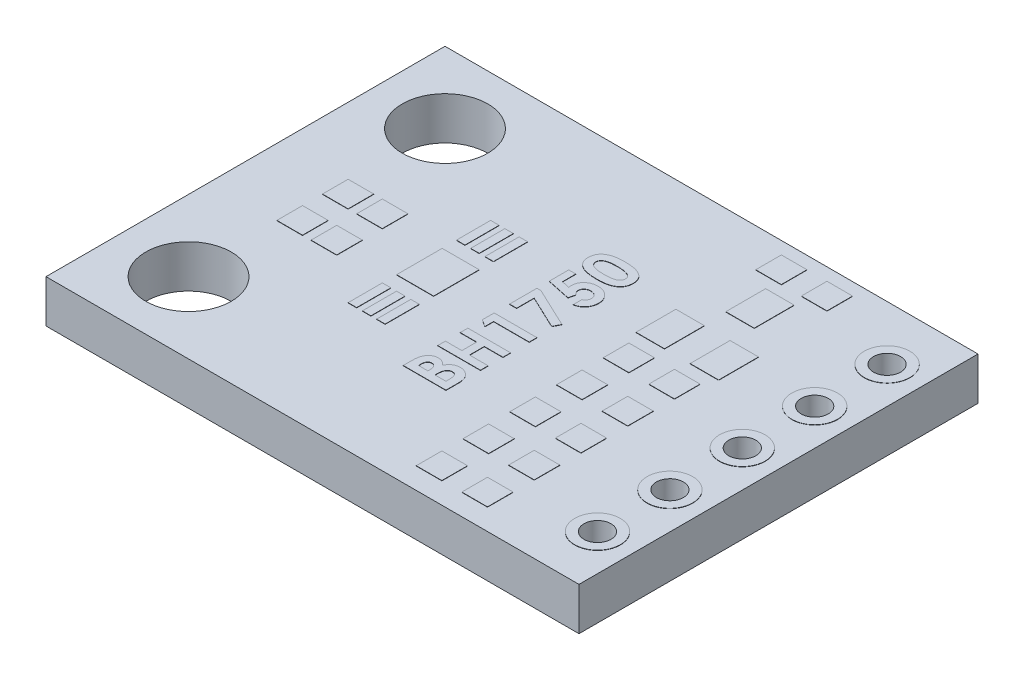
from build123d import *

# Parameters (mm, degrees)
SKETCH_1_W      = 18.7
SKETCH_1_H      = 14
SKETCH_1_R      = 1.5
SKETCH_1_R_2    = 0.475
EXTRUDE_1_DEPTH = 1.5
SKETCH_2_R      = 0.8
SKETCH_2_R_2    = 0.475
SKETCH_2_W      = 0.9
SKETCH_2_H      = 0.9
SKETCH_2_W_2    = 1
SKETCH_2_H_2    = 1.4
SKETCH_2_W_3    = 1.3
SKETCH_2_H_3    = 1.6
SKETCH_2_W_4    = 0.3
SKETCH_2_H_4    = 1.2
EXTRUDE_2_DEPTH = 0.01
EXTRUDE_4_DEPTH = 0.01
SKETCH_5_W      = 0.166666667
SKETCH_5_H      = 0.346153846
EXTRUDE_6_DEPTH = 0.01
EXTRUDE_START   = 0.01
SKETCH_6_R      = 0.8
SKETCH_6_R_2    = 0.47570587
EXTRUDE_7_DEPTH = 0.01


with BuildPart() as part:
    # Эскиз1 → Бобышка-Вытянуть1 (new body)
    with BuildSketch(Plane(origin=(0, 0, 0), x_dir=(1, 0, 0), z_dir=(0, 1, 0))):
        with Locations((9.35, 7)):
            Rectangle(SKETCH_1_W, SKETCH_1_H)
        with Locations(Location((2.5, 11.5, 0), (0, 0, 270))):
            Circle(SKETCH_1_R, mode=Mode.SUBTRACT)
        with Locations(Location((2.5, 2.5, 0), (0, 0, 90))):
            Circle(SKETCH_1_R, mode=Mode.SUBTRACT)
        with Locations(Location((17.43, 1.92, 0), (0, 0, 270))):
            Circle(SKETCH_1_R_2, mode=Mode.SUBTRACT)
        with Locations(Location((17.43, 4.46, 0), (0, 0, 270))):
            Circle(SKETCH_1_R_2, mode=Mode.SUBTRACT)
        with Locations(Location((17.43, 7, 0), (0, 0, 270))):
            Circle(SKETCH_1_R_2, mode=Mode.SUBTRACT)
        with Locations(Location((17.43, 9.54, 0), (0, 0, 270))):
            Circle(SKETCH_1_R_2, mode=Mode.SUBTRACT)
        with Locations(Location((17.43, 12.08, 0), (0, 0, 270))):
            Circle(SKETCH_1_R_2, mode=Mode.SUBTRACT)
    extrude(amount=EXTRUDE_1_DEPTH)

    # Эскиз2 → Бобышка-Вытянуть2 (add)
    # profile 1 of 31: a face of its own
    with BuildSketch(Plane(origin=(0, 1.5, 0), x_dir=(1, 0, 0), z_dir=(0, 1, 0))):
        with Locations(Location((17.43, 12.08, 0), (0, 0, 90))):
            Circle(SKETCH_2_R)
        with Locations(Location((17.43, 12.08, 0), (0, 0, 270))):
            Circle(SKETCH_2_R_2, mode=Mode.SUBTRACT)
    # profile 2 of 31: a face of its own
    with BuildSketch(Plane(origin=(0, 1.5, 0), x_dir=(1, 0, 0), z_dir=(0, 1, 0))):
        with Locations(Location((17.43, 9.54, 0), (0, 0, 90))):
            Circle(SKETCH_2_R)
        with Locations(Location((17.43, 9.54, 0), (0, 0, 270))):
            Circle(SKETCH_2_R_2, mode=Mode.SUBTRACT)
    # profile 3 of 31: a face of its own
    with BuildSketch(Plane(origin=(0, 1.5, 0), x_dir=(1, 0, 0), z_dir=(0, 1, 0))):
        with Locations(Location((17.43, 7, 0), (0, 0, 90))):
            Circle(SKETCH_2_R)
        with Locations(Location((17.43, 7, 0), (0, 0, 270))):
            Circle(SKETCH_2_R_2, mode=Mode.SUBTRACT)
    # profile 4 of 31: a face of its own
    with BuildSketch(Plane(origin=(0, 1.5, 0), x_dir=(1, 0, 0), z_dir=(0, 1, 0))):
        with Locations(Location((17.43, 4.46, 0), (0, 0, 90))):
            Circle(SKETCH_2_R)
        with Locations(Location((17.43, 4.46, 0), (0, 0, 270))):
            Circle(SKETCH_2_R_2, mode=Mode.SUBTRACT)
    # profile 5 of 31: a face of its own
    with BuildSketch(Plane(origin=(0, 1.5, 0), x_dir=(1, 0, 0), z_dir=(0, 1, 0))):
        with Locations(Location((17.43, 1.92, 0), (0, 0, 90))):
            Circle(SKETCH_2_R)
        with Locations(Location((17.43, 1.92, 0), (0, 0, 270))):
            Circle(SKETCH_2_R_2, mode=Mode.SUBTRACT)
    # profile 6 of 31: a face of its own
    with BuildSketch(Plane(origin=(0, 1.5, 0), x_dir=(1, 0, 0), z_dir=(0, 1, 0))):
        with Locations((12.7, 6.11)):
            Rectangle(SKETCH_2_W, SKETCH_2_H)
    # profile 7 of 31: a face of its own
    with BuildSketch(Plane(origin=(0, 1.5, 0), x_dir=(1, 0, 0), z_dir=(0, 1, 0))):
        with Locations((12.7, 13.1)):
            Rectangle(SKETCH_2_W, SKETCH_2_H)
    # profile 8 of 31: a face of its own
    with BuildSketch(Plane(origin=(0, 1.5, 0), x_dir=(1, 0, 0), z_dir=(0, 1, 0))):
        with Locations((14.3, 13.1)):
            Rectangle(SKETCH_2_W, SKETCH_2_H)
    # profile 9 of 31: a face of its own
    with BuildSketch(Plane(origin=(0, 1.5, 0), x_dir=(1, 0, 0), z_dir=(0, 1, 0))):
        with Locations((13.5, 11.55)):
            Rectangle(SKETCH_2_W_2, SKETCH_2_H_2)
    # profile 10 of 31: a face of its own
    with BuildSketch(Plane(origin=(0, 1.5, 0), x_dir=(1, 0, 0), z_dir=(0, 1, 0))):
        with Locations((12.55, 9.35)):
            Rectangle(SKETCH_2_W_2, SKETCH_2_H_2)
    # profile 11 of 31: a face of its own
    with BuildSketch(Plane(origin=(0, 1.5, 0), x_dir=(1, 0, 0), z_dir=(0, 1, 0))):
        with Locations((14.45, 9.35)):
            Rectangle(SKETCH_2_W_2, SKETCH_2_H_2)
    # profile 12 of 31: a face of its own
    with BuildSketch(Plane(origin=(0, 1.5, 0), x_dir=(1, 0, 0), z_dir=(0, 1, 0))):
        with Locations((14.3, 6.11)):
            Rectangle(SKETCH_2_W, SKETCH_2_H)
    # profile 13 of 31: a face of its own
    with BuildSketch(Plane(origin=(0, 1.5, 0), x_dir=(1, 0, 0), z_dir=(0, 1, 0))):
        with Locations((12.7, 7.75)):
            Rectangle(SKETCH_2_W, SKETCH_2_H)
    # profile 14 of 31: a face of its own
    with BuildSketch(Plane(origin=(0, 1.5, 0), x_dir=(1, 0, 0), z_dir=(0, 1, 0))):
        with Locations((14.3, 7.75)):
            Rectangle(SKETCH_2_W, SKETCH_2_H)
    # profile 15 of 31: a face of its own
    with BuildSketch(Plane(origin=(0, 1.5, 0), x_dir=(1, 0, 0), z_dir=(0, 1, 0))):
        with Locations((12.7, 4.47)):
            Rectangle(SKETCH_2_W, SKETCH_2_H)
    # profile 16 of 31: a face of its own
    with BuildSketch(Plane(origin=(0, 1.5, 0), x_dir=(1, 0, 0), z_dir=(0, 1, 0))):
        with Locations((14.3, 4.47)):
            Rectangle(SKETCH_2_W, SKETCH_2_H)
    # profile 17 of 31: a face of its own
    with BuildSketch(Plane(origin=(0, 1.5, 0), x_dir=(1, 0, 0), z_dir=(0, 1, 0))):
        with Locations((12.7, 2.83)):
            Rectangle(SKETCH_2_W, SKETCH_2_H)
    # profile 18 of 31: a face of its own
    with BuildSketch(Plane(origin=(0, 1.5, 0), x_dir=(1, 0, 0), z_dir=(0, 1, 0))):
        with Locations((14.3, 2.83)):
            Rectangle(SKETCH_2_W, SKETCH_2_H)
    # profile 19 of 31: a face of its own
    with BuildSketch(Plane(origin=(0, 1.5, 0), x_dir=(1, 0, 0), z_dir=(0, 1, 0))):
        with Locations((12.7, 1.19)):
            Rectangle(SKETCH_2_W, SKETCH_2_H)
    # profile 20 of 31: a face of its own
    with BuildSketch(Plane(origin=(0, 1.5, 0), x_dir=(1, 0, 0), z_dir=(0, 1, 0))):
        with Locations((14.3, 1.19)):
            Rectangle(SKETCH_2_W, SKETCH_2_H)
    # profile 21 of 31: a face of its own
    with BuildSketch(Plane(origin=(0, 1.5, 0), x_dir=(1, 0, 0), z_dir=(0, 1, 0))):
        with Locations((4, 6.2)):
            Rectangle(SKETCH_2_W, SKETCH_2_H)
    # profile 22 of 31: a face of its own
    with BuildSketch(Plane(origin=(0, 1.5, 0), x_dir=(1, 0, 0), z_dir=(0, 1, 0))):
        with Locations((2.8, 6.2)):
            Rectangle(SKETCH_2_W, SKETCH_2_H)
    # profile 23 of 31: a face of its own
    with BuildSketch(Plane(origin=(0, 1.5, 0), x_dir=(1, 0, 0), z_dir=(0, 1, 0))):
        with Locations((2.8, 7.8)):
            Rectangle(SKETCH_2_W, SKETCH_2_H)
    # profile 24 of 31: a face of its own
    with BuildSketch(Plane(origin=(0, 1.5, 0), x_dir=(1, 0, 0), z_dir=(0, 1, 0))):
        with Locations((4, 7.8)):
            Rectangle(SKETCH_2_W, SKETCH_2_H)
    # profile 25 of 31: a face of its own
    with BuildSketch(Plane(origin=(0, 1.5, 0), x_dir=(1, 0, 0), z_dir=(0, 1, 0))):
        with Locations((6.75, 7)):
            Rectangle(SKETCH_2_W_3, SKETCH_2_H_3)
    # profile 26 of 31: a face of its own
    with BuildSketch(Plane(origin=(0, 1.5, 0), x_dir=(1, 0, 0), z_dir=(0, 1, 0))):
        with Locations((7.25, 8.9)):
            Rectangle(SKETCH_2_W_4, SKETCH_2_H_4)
    # profile 27 of 31: a face of its own
    with BuildSketch(Plane(origin=(0, 1.5, 0), x_dir=(1, 0, 0), z_dir=(0, 1, 0))):
        with Locations((6.75, 8.9)):
            Rectangle(SKETCH_2_W_4, SKETCH_2_H_4)
    # profile 28 of 31: a face of its own
    with BuildSketch(Plane(origin=(0, 1.5, 0), x_dir=(1, 0, 0), z_dir=(0, 1, 0))):
        with Locations((6.25, 8.9)):
            Rectangle(SKETCH_2_W_4, SKETCH_2_H_4)
    # profile 29 of 31: a face of its own
    with BuildSketch(Plane(origin=(0, 1.5, 0), x_dir=(1, 0, 0), z_dir=(0, 1, 0))):
        with Locations((6.25, 5.1)):
            Rectangle(SKETCH_2_W_4, SKETCH_2_H_4)
    # profile 30 of 31: a face of its own
    with BuildSketch(Plane(origin=(0, 1.5, 0), x_dir=(1, 0, 0), z_dir=(0, 1, 0))):
        with Locations((7.25, 5.1)):
            Rectangle(SKETCH_2_W_4, SKETCH_2_H_4)
    # profile 31 of 31: a face of its own
    with BuildSketch(Plane(origin=(0, 1.5, 0), x_dir=(1, 0, 0), z_dir=(0, 1, 0))):
        with Locations((6.75, 5.1)):
            Rectangle(SKETCH_2_W_4, SKETCH_2_H_4)
    extrude(amount=EXTRUDE_2_DEPTH)

    # Эскиз3 → Бобышка-Вытянуть4 (add)
    # profile 1 of 6: a face of its own
    with BuildSketch(Plane(origin=(0, 1.5, 0), x_dir=(1, 0, 0), z_dir=(0, 1, 0))):
        with BuildLine():
            Line((10.475, 3.557692308), (8.975, 3.557692308))
            Line((8.975, 3.557692308), (8.975, 3.798076923))
            add(Edge.make_bspline(
                [(8.975, 3.798076923), (8.974998079, 3.814905349), (8.974994363, 3.847468035), (8.976644128, 3.894447492), (8.978778282, 3.938016971), (8.981165906, 3.978037817), (8.985280257, 4.014578148), (8.989616334, 4.047582398), (8.994845376, 4.077116511), (8.999535989, 4.095375848), (9.001742788, 4.103966346)],
                knots=[0, 0, 0, 0, 1.311965854, 2.538629056, 3.664479157, 4.713267157, 5.663616078, 6.530575999, 7.308677837, 8, 8, 8, 8], degree=3))
            add(Edge.make_bspline(
                [(9.001742788, 4.103966346), (9.004855642, 4.115246444), (9.010964059, 4.137381618), (9.023298038, 4.169087924), (9.037016473, 4.199159331), (9.052636172, 4.227589291), (9.07044848, 4.25404147), (9.09011352, 4.278878839), (9.111638456, 4.3019845), (9.135148905, 4.322995217), (9.16003265, 4.341945116), (9.186275167, 4.358530436), (9.213589518, 4.372679064), (9.242033893, 4.384232155), (9.271572731, 4.392850857), (9.302112441, 4.399170727), (9.333763214, 4.403262819), (9.355295761, 4.403649745), (9.366225962, 4.403846154)],
                knots=[0, 0, 0, 0, 1.099825721, 2.158211141, 3.195041695, 4.206926465, 5.204905297, 6.190538631, 7.183526201, 8.170733634, 9.152262494, 10.121785545, 11.086538014, 12.041584943, 13.004265891, 13.975982849, 14.972582673, 16, 16, 16, 16], degree=3))
            add(Edge.make_bspline(
                [(9.366225962, 4.403846154), (9.380269114, 4.403334203), (9.407911333, 4.402326492), (9.448501434, 4.395852019), (9.486820813, 4.383848822), (9.523543819, 4.367756728), (9.558896477, 4.346507386), (9.592439603, 4.319032026), (9.625331303, 4.286343761), (9.645038129, 4.261249615), (9.655288462, 4.248197115)],
                knots=[0, 0, 0, 0, 0.986208652, 1.941230559, 2.875571179, 3.798165321, 4.751009532, 5.761494368, 6.83566093, 8, 8, 8, 8], degree=3))
            add(Edge.make_bspline(
                [(9.655288462, 4.248197115), (9.660686709, 4.258773416), (9.671271178, 4.279510617), (9.688678961, 4.308942135), (9.707156322, 4.33622713), (9.726461182, 4.361274042), (9.746883213, 4.384237276), (9.768355326, 4.404750027), (9.790772371, 4.423340986), (9.814288688, 4.439644839), (9.839024891, 4.453698784), (9.864618368, 4.466063324), (9.891296446, 4.476707777), (9.919116995, 4.485357543), (9.948044799, 4.492031863), (9.978012879, 4.496317161), (10.008982105, 4.49961448), (10.030078721, 4.499870054), (10.040805288, 4.5)],
                knots=[0, 0, 0, 0, 1.164539168, 2.28333912, 3.351515688, 4.395009163, 5.383055728, 6.362812631, 7.305003804, 8.237049474, 9.165619381, 10.092784925, 11.02322402, 11.98030579, 12.947919037, 13.931657808, 14.948352129, 16, 16, 16, 16], degree=3))
            add(Edge.make_bspline(
                [(10.040805288, 4.5), (10.061292738, 4.499155807), (10.101724638, 4.497489795), (10.16107911, 4.485278986), (10.217304517, 4.464222543), (10.270104539, 4.435677001), (10.318184931, 4.400679824), (10.360647024, 4.360654857), (10.396323954, 4.315481291), (10.420434308, 4.273929196), (10.436588065, 4.237971802), (10.446621268, 4.208200148), (10.455732108, 4.176168463), (10.462861106, 4.141513219), (10.468158703, 4.104471984), (10.472022402, 4.065069384), (10.474458085, 4.023167281), (10.47481571, 3.994394456), (10.475, 3.979567308)],
                knots=[0, 0, 0, 0, 1.284195246, 2.534354168, 3.78027825, 5.036354521, 6.286276797, 7.499025881, 8.683874548, 9.882754589, 10.501292686, 11.152751137, 11.850656415, 12.588451682, 13.369156733, 14.195917516, 15.070324243, 16, 16, 16, 16], degree=3))
            Line((10.475, 3.979567308), (10.475, 3.557692308))
        make_face()
        with BuildLine():
            Line((9.244230769, 3.826923077), (9.571153846, 3.826923077))
            Line((9.571153846, 3.826923077), (9.571153846, 3.8984375))
            add(Edge.make_bspline(
                [(9.571153846, 3.8984375), (9.571069089, 3.908156953), (9.57090547, 3.926919768), (9.568798116, 3.954020664), (9.565202839, 3.979220121), (9.560186524, 4.002422562), (9.553816535, 4.023844127), (9.546152066, 4.043347969), (9.536800581, 4.060848332), (9.522871131, 4.081179706), (9.502373322, 4.102671435), (9.47275999, 4.121590363), (9.438704771, 4.132733485), (9.414686394, 4.133974528), (9.402283654, 4.134615385)],
                knots=[0, 0, 0, 0, 1.065314748, 2.056525647, 2.977365736, 3.853934255, 4.656397591, 5.425096493, 6.14721249, 6.826394842, 8.123232004, 9.372140726, 10.643011755, 12, 12, 12, 12], degree=3))
            add(Edge.make_bspline(
                [(9.402283654, 4.134615385), (9.390666398, 4.13410259), (9.3682049, 4.133111122), (9.336667438, 4.121891321), (9.308716925, 4.104465339), (9.28959308, 4.083889659), (9.27651783, 4.064517933), (9.267951641, 4.047918144), (9.260115197, 4.029775807), (9.254829392, 4.009437809), (9.249772474, 3.987556048), (9.246713562, 3.963707259), (9.244450277, 3.938145039), (9.244305508, 3.920478653), (9.244230769, 3.911358173)],
                knots=[0, 0, 0, 0, 1.348076466, 2.606451671, 3.849585156, 5.153713056, 5.843081946, 6.568636199, 7.327130502, 8.139792284, 9.011860696, 9.942616599, 10.937851541, 12, 12, 12, 12], degree=3))
            Line((9.244230769, 3.911358173), (9.244230769, 3.826923077))
        make_face(mode=Mode.SUBTRACT)
        with BuildLine():
            Line((9.821153846, 3.826923077), (10.205769231, 3.826923077))
            Line((10.205769231, 3.826923077), (10.205769231, 3.904447115))
            add(Edge.make_bspline(
                [(10.205769231, 3.904447115), (10.205680094, 3.91977334), (10.205508717, 3.949239918), (10.203495422, 3.991456731), (10.199761293, 4.029821568), (10.195401517, 4.064343456), (10.18850799, 4.094739828), (10.181340498, 4.121565822), (10.172121088, 4.144356589), (10.161429874, 4.163501069), (10.149336196, 4.179512323), (10.136247728, 4.193376965), (10.12162272, 4.204941113), (10.105784693, 4.214241262), (10.08887979, 4.222053757), (10.070346878, 4.22683952), (10.050762305, 4.230466183), (10.037218127, 4.23066666), (10.030288462, 4.230769231)],
                knots=[0, 0, 0, 0, 1.753677247, 3.371663338, 4.833688836, 6.164395063, 7.349095089, 8.3975697, 9.338276771, 10.154261968, 10.899224605, 11.628775934, 12.330426574, 13.024264642, 13.727131073, 14.452891561, 15.208446408, 16, 16, 16, 16], degree=3))
            add(Edge.make_bspline(
                [(10.030288462, 4.230769231), (10.022363865, 4.230544113), (10.006928882, 4.230105645), (9.984372598, 4.226513987), (9.963301174, 4.220013972), (9.943160767, 4.211705086), (9.924527856, 4.200464731), (9.907119001, 4.186773903), (9.891355092, 4.170388253), (9.876314585, 4.151922818), (9.863036724, 4.130490336), (9.852037205, 4.105730402), (9.842361058, 4.07801784), (9.834788006, 4.046887537), (9.828315479, 4.012617678), (9.824461451, 3.974927018), (9.821591269, 3.934138874), (9.821302967, 3.905855294), (9.821153846, 3.891225962)],
                knots=[0, 0, 0, 0, 0.844975127, 1.645784239, 2.426462591, 3.192310282, 3.963577212, 4.739343514, 5.547598874, 6.383408773, 7.27567655, 8.226932621, 9.267447238, 10.402227125, 11.640487588, 12.984111775, 14.440069075, 16, 16, 16, 16], degree=3))
            Line((9.821153846, 3.891225962), (9.821153846, 3.826923077))
        make_face(mode=Mode.SUBTRACT)
    # profile 2 of 6: a face of its own
    with BuildSketch(Plane(origin=(0, 1.5, 0), x_dir=(1, 0, 0), z_dir=(0, 1, 0))):
        Polygon((8.975, 4.769230769), (8.975, 5.038461538), (9.551923077, 5.038461538), (9.551923077, 5.557692308), (8.975, 5.557692308), (8.975, 5.826923077), (10.475, 5.826923077), (10.475, 5.557692308), (9.821153846, 5.557692308), (9.821153846, 5.038461538), (10.475, 5.038461538), (10.475, 4.769230769), align=None)
    # profile 3 of 6: a face of its own
    with BuildSketch(Plane(origin=(0, 1.5, 0), x_dir=(1, 0, 0), z_dir=(0, 1, 0))):
        Polygon((8.975, 6.333834135), (8.975, 6.75), (10.475, 6.75), (10.475, 6.480769231), (9.225, 6.480769231), (9.225, 6.173076923), align=None)
    # profile 4 of 6: a face of its own
    with BuildSketch(Plane(origin=(0, 1.5, 0), x_dir=(1, 0, 0), z_dir=(0, 1, 0))):
        Polygon((8.975, 7.288461538), (8.975, 8.25), (9.114723558, 8.25), (10.513461538, 7.588341346), (10.393269231, 7.349759615), (9.225, 7.902644231), (9.225, 7.288461538), align=None)
    # profile 5 of 6: a face of its own
    with BuildSketch(Plane(origin=(0, 1.5, 0), x_dir=(1, 0, 0), z_dir=(0, 1, 0))):
        with BuildLine():
            Line((8.975, 8.682391827), (8.975, 9.365384615))
            Line((8.975, 9.365384615), (9.225, 9.365384615))
            Line((9.225, 9.365384615), (9.225, 8.895733173))
            Line((9.225, 8.895733173), (9.508653846, 8.837139423))
            add(Edge.make_bspline(
                [(9.508653846, 8.837139423), (9.506430135, 8.84512366), (9.502044521, 8.860870216), (9.497646304, 8.884592423), (9.49479552, 8.907582547), (9.494415263, 8.922668526), (9.494230769, 8.929987981)],
                knots=[0, 0, 0, 0, 1.05461699, 2.079921384, 3.068411212, 4, 4, 4, 4], degree=3))
            add(Edge.make_bspline(
                [(9.494230769, 8.929987981), (9.494596251, 8.94593784), (9.495316696, 8.977378526), (9.50215607, 9.023372259), (9.512927877, 9.067413976), (9.528290695, 9.109368904), (9.548285801, 9.149196059), (9.572474273, 9.186943718), (9.600898596, 9.222658211), (9.633576566, 9.255705098), (9.669457718, 9.286069959), (9.708266979, 9.312470473), (9.749450969, 9.335018159), (9.793265685, 9.35295181), (9.839435943, 9.367106576), (9.887991329, 9.377335125), (9.938989388, 9.383383778), (9.973781718, 9.384199402), (9.991526442, 9.384615385)],
                knots=[0, 0, 0, 0, 1.01440847, 1.999622559, 2.951875003, 3.895578053, 4.836219714, 5.782137149, 6.743708247, 7.735272588, 8.734977101, 9.730283169, 10.717124674, 11.717316708, 12.737475749, 13.78628267, 14.87096371, 16, 16, 16, 16], degree=3))
            add(Edge.make_bspline(
                [(9.991526442, 9.384615385), (10.009472405, 9.384106634), (10.044885034, 9.383102721), (10.096957672, 9.376564339), (10.1468179, 9.364991891), (10.194576462, 9.349233318), (10.239822109, 9.328054965), (10.28339341, 9.30330309), (10.324354487, 9.273182486), (10.36282746, 9.239149475), (10.398015602, 9.202000712), (10.428890277, 9.162348682), (10.455330441, 9.120858847), (10.476300708, 9.076944206), (10.492975503, 9.031276361), (10.505088287, 8.983696791), (10.512040187, 8.934000256), (10.512982548, 8.900261803), (10.513461538, 8.883112981)],
                knots=[0, 0, 0, 0, 1.068214675, 2.107899807, 3.117335077, 4.110871058, 5.095206435, 6.086091645, 7.088956472, 8.115291905, 9.140102477, 10.129911027, 11.102477109, 12.062389472, 13.02046727, 13.992137592, 14.979429371, 16, 16, 16, 16], degree=3))
            add(Edge.make_bspline(
                [(10.513461538, 8.883112981), (10.513056766, 8.867780348), (10.512258469, 8.837541188), (10.507689035, 8.792929281), (10.498614184, 8.750143048), (10.487220971, 8.708760639), (10.47151607, 8.669354195), (10.45346855, 8.631111689), (10.430810232, 8.595184352), (10.405848795, 8.560551505), (10.377500325, 8.528544548), (10.346867096, 8.49882702), (10.313376487, 8.472529353), (10.277679429, 8.44867179), (10.239109384, 8.428550584), (10.198360146, 8.410563392), (10.154973033, 8.395868908), (10.124898822, 8.388407303), (10.109615385, 8.384615385)],
                knots=[0, 0, 0, 0, 1.055144606, 2.080965977, 3.079696235, 4.061281178, 5.030010203, 5.994686618, 6.966205752, 7.947572972, 8.929036963, 9.903776773, 10.879904045, 11.854643856, 12.853445432, 13.868704235, 14.916895142, 16, 16, 16, 16], degree=3))
            Line((10.109615385, 8.384615385), (10.109615385, 8.692307692))
            add(Edge.make_bspline(
                [(10.109615385, 8.692307692), (10.120208992, 8.697930526), (10.140796459, 8.708857862), (10.168087431, 8.729675345), (10.191474731, 8.752820513), (10.210525704, 8.778670965), (10.225622084, 8.806368484), (10.2365949, 8.835773214), (10.243032744, 8.86670754), (10.243828789, 8.887790974), (10.244230769, 8.8984375)],
                knots=[0, 0, 0, 0, 1.10506944, 2.147576346, 3.153981456, 4.13180336, 5.099527609, 6.055753385, 7.01821161, 8, 8, 8, 8], degree=3))
            add(Edge.make_bspline(
                [(10.244230769, 8.8984375), (10.243951611, 8.905857062), (10.243402362, 8.920455176), (10.240496699, 8.941963188), (10.234993439, 8.96249353), (10.227372703, 8.982198841), (10.217868785, 9.001132054), (10.205870707, 9.019021755), (10.192060475, 9.036179192), (10.176213187, 9.05234316), (10.158547146, 9.066983056), (10.139563782, 9.079820643), (10.119684907, 9.091299217), (10.098123071, 9.099801571), (10.075522117, 9.106764281), (10.051711559, 9.111891902), (10.026663588, 9.114956234), (10.009564041, 9.115239909), (10.000841346, 9.115384615)],
                knots=[0, 0, 0, 0, 0.978869489, 1.925942215, 2.855067702, 3.774946051, 4.70828698, 5.642468714, 6.60995405, 7.609372294, 8.622401667, 9.629904756, 10.629323, 11.642352373, 12.678539694, 13.745912462, 14.850161547, 16, 16, 16, 16], degree=3))
            add(Edge.make_bspline(
                [(10.000841346, 9.115384615), (9.992321125, 9.115216667), (9.975736308, 9.114889752), (9.951383857, 9.11218544), (9.928277782, 9.107347482), (9.906241137, 9.100755711), (9.885407636, 9.0923175), (9.86565364, 9.082005289), (9.84707762, 9.069775716), (9.830062876, 9.055560544), (9.814441992, 9.040409144), (9.800831419, 9.024104721), (9.789379697, 9.006954861), (9.780023237, 8.988991293), (9.77227104, 8.97037865), (9.767453043, 8.950697003), (9.763775574, 8.930425162), (9.763567308, 8.916584389), (9.763461538, 8.909555288)],
                knots=[0, 0, 0, 0, 1.166353127, 2.270334681, 3.348811111, 4.394351869, 5.415506664, 6.421447184, 7.440758738, 8.453871, 9.452682422, 10.416618495, 11.356052082, 12.270018172, 13.186757755, 14.10810127, 15.039190426, 16, 16, 16, 16], degree=3))
            add(Edge.make_bspline(
                [(9.763461538, 8.909555288), (9.763743327, 8.90191868), (9.764308093, 8.886613278), (9.769144945, 8.863952218), (9.776303988, 8.841364582), (9.786993665, 8.819144219), (9.800709125, 8.797082156), (9.817279795, 8.775140414), (9.836970535, 8.753407752), (9.851696625, 8.739675995), (9.859314904, 8.732572115)],
                knots=[0, 0, 0, 0, 0.882519632, 1.768758668, 2.670168731, 3.618680561, 4.612333577, 5.671392632, 6.795336641, 8, 8, 8, 8], degree=3))
            Line((9.859314904, 8.732572115), (9.807331731, 8.506009615))
            Line((9.807331731, 8.506009615), (8.975, 8.682391827))
        make_face()
    # profile 6 of 6: a face of its own
    with BuildSketch(Plane(origin=(0, 1.5, 0), x_dir=(1, 0, 0), z_dir=(0, 1, 0))):
        with BuildLine():
            add(Edge.make_bspline(
                [(8.936538462, 10.08203125), (8.936731884, 10.095063157), (8.937112204, 10.120687368), (8.941232792, 10.158426657), (8.947454918, 10.194781374), (8.956143009, 10.229887463), (8.967604055, 10.263515045), (8.981437327, 10.295781762), (8.997773394, 10.326658502), (9.016687362, 10.35617797), (9.038471272, 10.384076502), (9.062489355, 10.410805174), (9.089669831, 10.435292283), (9.119309281, 10.458277757), (9.151584914, 10.479604615), (9.186402729, 10.499410588), (9.223977612, 10.51749824), (9.264364786, 10.534083304), (9.308173227, 10.548912961), (9.355904401, 10.561404175), (9.407569509, 10.572117418), (9.463297066, 10.581160169), (9.523161173, 10.587995023), (9.587122051, 10.592601853), (9.655056395, 10.595763277), (9.701658797, 10.596021291), (9.725600962, 10.596153846)],
                knots=[0, 0, 0, 0, 0.879187688, 1.728717895, 2.558878706, 3.367146394, 4.166631857, 4.95393622, 5.734098362, 6.521634849, 7.316678452, 8.120609651, 8.943639266, 9.781961388, 10.650008082, 11.55217958, 12.483362701, 13.462505087, 14.497127373, 15.602264045, 16.790140859, 18.057036744, 19.411188506, 20.855078804, 22.384284574, 24, 24, 24, 24], degree=3))
            add(Edge.make_bspline(
                [(9.725600962, 10.596153846), (9.749842663, 10.596010566), (9.796943853, 10.595732175), (9.865499649, 10.592733527), (9.929924608, 10.587568039), (9.990213851, 10.580915638), (10.046329485, 10.571785597), (10.098342513, 10.561170959), (10.146262754, 10.548368838), (10.190094125, 10.53313623), (10.23059104, 10.516525636), (10.268241702, 10.498676321), (10.302766769, 10.478814227), (10.335259687, 10.458749529), (10.364299951, 10.436243361), (10.391030189, 10.412962255), (10.41442742, 10.387723032), (10.435715942, 10.36161794), (10.454112628, 10.33368294), (10.470202298, 10.304208116), (10.483252872, 10.272667449), (10.494603582, 10.239636015), (10.502752162, 10.204550747), (10.509217794, 10.167969156), (10.512791099, 10.129478241), (10.513234391, 10.103272075), (10.513461538, 10.08984375)],
                knots=[0, 0, 0, 0, 1.643824397, 3.193921316, 4.652018541, 6.026147715, 7.305813021, 8.506024873, 9.624771103, 10.66654028, 11.650369642, 12.592128821, 13.489360096, 14.35046321, 15.179132238, 15.977837183, 16.751455772, 17.509897991, 18.259653136, 19.016390304, 19.783391144, 20.571659993, 21.382176161, 22.223003704, 23.089447706, 24, 24, 24, 24], degree=3))
            add(Edge.make_bspline(
                [(10.513461538, 10.08984375), (10.513229963, 10.076415812), (10.512776312, 10.050110678), (10.509244871, 10.011515339), (10.502724162, 9.974741108), (10.494547516, 9.939373871), (10.483254416, 9.905685653), (10.469904862, 9.873377398), (10.453487755, 9.843087975), (10.435127332, 9.814193269), (10.413968029, 9.787149629), (10.390342309, 9.761556168), (10.364581345, 9.737054882), (10.335789993, 9.714518675), (10.304494178, 9.693544471), (10.270698238, 9.673909682), (10.234291701, 9.656013131), (10.195284408, 9.6392563), (10.152740385, 9.624431154), (10.106259592, 9.611647332), (10.055493939, 9.600819332), (10.000494227, 9.592309048), (9.94125314, 9.585446263), (9.87781821, 9.580356955), (9.810166012, 9.577340029), (9.763665028, 9.577064788), (9.739723558, 9.576923077)],
                knots=[0, 0, 0, 0, 0.917318694, 1.797013832, 2.644089644, 3.467281984, 4.274391433, 5.068665368, 5.852346333, 6.624865025, 7.405043053, 8.194438745, 9.002823433, 9.831034161, 10.688848002, 11.574933485, 12.499091769, 13.45866927, 14.473616003, 15.574277631, 16.749933499, 18.017757418, 19.374908438, 20.82337846, 22.364486432, 24, 24, 24, 24], degree=3))
            add(Edge.make_bspline(
                [(9.739723558, 9.576923077), (9.706458801, 9.577179945), (9.642274025, 9.577675574), (9.549545685, 9.583956554), (9.463834397, 9.59317544), (9.385283536, 9.606715799), (9.313602172, 9.623458267), (9.249262504, 9.644897868), (9.191374249, 9.669305294), (9.157080898, 9.690103557), (9.140564904, 9.700120192)],
                knots=[0, 0, 0, 0, 1.288568992, 2.486310467, 3.599230591, 4.627010532, 5.572937695, 6.447898582, 7.252493626, 8, 8, 8, 8], degree=3))
            add(Edge.make_bspline(
                [(9.140564904, 9.700120192), (9.124339596, 9.711767059), (9.092615922, 9.734538978), (9.050968668, 9.774356315), (9.015349897, 9.81713486), (8.986565694, 9.863753258), (8.963866469, 9.913474222), (8.947834262, 9.966724631), (8.938493151, 10.02330784), (8.937199755, 10.062164473), (8.936538462, 10.08203125)],
                knots=[0, 0, 0, 0, 1.058512271, 2.069600068, 3.047294572, 4.004278952, 4.967380941, 5.939006123, 6.946246673, 8, 8, 8, 8], degree=3))
        make_face()
        with BuildLine():
            add(Edge.make_bspline(
                [(9.205769231, 10.088641827), (9.206329334, 10.076862101), (9.207427432, 10.053767586), (9.216695777, 10.020235595), (9.231119577, 9.988752736), (9.248041171, 9.964538924), (9.264604964, 9.94662048), (9.279579013, 9.934042352), (9.296301516, 9.921917837), (9.315518095, 9.911221637), (9.336594291, 9.901018818), (9.359590818, 9.891356062), (9.384882224, 9.883047369), (9.412298243, 9.875122973), (9.442502668, 9.86826938), (9.475787299, 9.862272525), (9.512265779, 9.85716379), (9.552091006, 9.853479278), (9.595054295, 9.850096233), (9.641340915, 9.847660327), (9.690941141, 9.846644184), (9.725099962, 9.846320758), (9.742728365, 9.846153846)],
                knots=[0, 0, 0, 0, 1.076486532, 2.110485037, 3.16053299, 4.233735637, 4.798028448, 5.389657808, 6.0205397, 6.6857231, 7.399126456, 8.163539924, 8.966557062, 9.834164971, 10.774831688, 11.799768806, 12.928987201, 14.14492726, 15.459726247, 16.873396567, 18.386448164, 20, 20, 20, 20], degree=3))
            add(Edge.make_bspline(
                [(9.742728365, 9.846153846), (9.765566702, 9.846429245), (9.809360905, 9.846957342), (9.872340502, 9.84970486), (9.929748742, 9.855277183), (9.981807764, 9.862045426), (10.028214061, 9.871819746), (10.069379868, 9.882881009), (10.104935884, 9.896608169), (10.135308832, 9.912464852), (10.161146768, 9.930028523), (10.183109193, 9.949094272), (10.202127602, 9.969013428), (10.217576024, 9.990407621), (10.229414982, 10.01322584), (10.237930599, 10.037277587), (10.243143362, 10.062578148), (10.243866205, 10.079903711), (10.244230769, 10.088641827)],
                knots=[0, 0, 0, 0, 1.771738815, 3.39744054, 4.888007323, 6.245018868, 7.467093912, 8.564230264, 9.548241846, 10.417081984, 11.216594933, 11.965786359, 12.669352538, 13.348558586, 14.005353126, 14.656563323, 15.322440191, 16, 16, 16, 16], degree=3))
            add(Edge.make_bspline(
                [(10.244230769, 10.088641827), (10.243981307, 10.097080078), (10.243492892, 10.113601125), (10.238479371, 10.137692512), (10.230328474, 10.160475039), (10.218798459, 10.181879919), (10.204136281, 10.201983714), (10.186277508, 10.220688169), (10.165044129, 10.23785222), (10.149285822, 10.247852073), (10.141165865, 10.253004808)],
                knots=[0, 0, 0, 0, 0.992283464, 1.942767638, 2.88273346, 3.832339453, 4.79467288, 5.803907806, 6.868395428, 8, 8, 8, 8], degree=3))
            add(Edge.make_bspline(
                [(10.141165865, 10.253004808), (10.130070205, 10.259071285), (10.106803504, 10.271792195), (10.067541814, 10.286512855), (10.023261117, 10.298903885), (9.973823607, 10.309568664), (9.919034296, 10.316862722), (9.859240608, 10.323144357), (9.794141447, 10.326174145), (9.749040513, 10.326666956), (9.725600962, 10.326923077)],
                knots=[0, 0, 0, 0, 0.710965849, 1.490837728, 2.352621235, 3.297892224, 4.334225155, 5.461620853, 6.680770821, 8, 8, 8, 8], degree=3))
            add(Edge.make_bspline(
                [(9.725600962, 10.326923077), (9.701957944, 10.326824143), (9.656449171, 10.326633712), (9.591115973, 10.323139858), (9.53144494, 10.318274399), (9.477569293, 10.311157636), (9.429358245, 10.302000628), (9.386814948, 10.290714581), (9.349855557, 10.277409171), (9.318516926, 10.26163054), (9.291883389, 10.244154727), (9.26903388, 10.225603617), (9.249525545, 10.205898769), (9.233284972, 10.185073137), (9.220875957, 10.162644703), (9.212114165, 10.139041881), (9.206813575, 10.114216282), (9.206122044, 10.097281709), (9.205769231, 10.088641827)],
                knots=[0, 0, 0, 0, 1.793836731, 3.452829483, 4.963243077, 6.335886805, 7.574563692, 8.684454726, 9.672768357, 10.54971625, 11.340229787, 12.085688095, 12.778991901, 13.440269426, 14.083255152, 14.715733572, 15.344777694, 16, 16, 16, 16], degree=3))
        make_face(mode=Mode.SUBTRACT)
    extrude(amount=EXTRUDE_4_DEPTH)

    # Эскиз5 → Бобышка-Вытянуть6 (add)
    # profile 1 of 22: a face of its own
    with BuildSketch(Plane.XZ):
        Polygon((15.031722756, -2.42), (14.86525641, -2.42), (14.461410256, -1.42), (14.653116987, -1.42), (14.730841346, -1.625128205), (15.166538462, -1.625128205), (15.244262821, -1.42), (15.435769231, -1.42), align=None)
        Polygon((14.948589744, -2.151770833), (15.098429487, -1.804615385), (14.79875, -1.804615385), align=None, mode=Mode.SUBTRACT)
    # profile 2 of 22: a face of its own
    with BuildSketch(Plane.XZ):
        with BuildLine():
            Line((14.313974359, -2.42), (14.0878125, -2.42))
            add(Edge.make_bspline(
                [(14.0878125, -2.42), (14.070180152, -2.419879592), (14.036096625, -2.419646841), (13.986723318, -2.416924059), (13.940778093, -2.412925777), (13.898364886, -2.406806587), (13.859330965, -2.399704309), (13.82396446, -2.390192851), (13.791977544, -2.379277634), (13.763034516, -2.366559899), (13.736684514, -2.351644941), (13.71184174, -2.334888605), (13.688219399, -2.316039505), (13.66568658, -2.295053763), (13.64418837, -2.272070914), (13.624229421, -2.246628177), (13.605169864, -2.219384554), (13.587318942, -2.19024549), (13.571429392, -2.159268511), (13.557285911, -2.126941173), (13.545501837, -2.093242466), (13.535906826, -2.058218919), (13.528263869, -2.021971986), (13.522914894, -1.984432604), (13.519608445, -1.945634401), (13.519273009, -1.919338996), (13.519102564, -1.905977564)],
                knots=[0, 0, 0, 0, 1.44349102, 2.790284463, 4.047513061, 5.218094321, 6.297837468, 7.293772999, 8.213586047, 9.062895527, 9.878013142, 10.689252941, 11.514048747, 12.349645483, 13.208421871, 14.087867281, 14.994836234, 15.929653487, 16.883274053, 17.843080533, 18.816554169, 19.803369425, 20.81449504, 21.847452076, 22.906230055, 24, 24, 24, 24], degree=3))
            add(Edge.make_bspline(
                [(13.519102564, -1.905977564), (13.519548835, -1.887123689), (13.520427346, -1.850008731), (13.527828232, -1.795543295), (13.539796018, -1.743331451), (13.556630624, -1.693787649), (13.577477385, -1.647331403), (13.602443954, -1.604893312), (13.630813153, -1.566386872), (13.662836725, -1.532450983), (13.69745569, -1.503104041), (13.73357269, -1.478263313), (13.771155413, -1.458324101), (13.804340798, -1.445872589), (13.833197714, -1.438046763), (13.858496297, -1.433500482), (13.887288272, -1.429283992), (13.919682153, -1.425659808), (13.955774005, -1.423177958), (13.995452063, -1.421464065), (14.038725938, -1.420190534), (14.068781025, -1.420065175), (14.084407051, -1.42)],
                knots=[0, 0, 0, 0, 1.315347898, 2.589339334, 3.828278609, 5.048487211, 6.235212834, 7.375728391, 8.47833097, 9.56625089, 10.624194351, 11.640157642, 12.619895326, 13.585848527, 14.106971868, 14.704705962, 15.37825295, 16.137840974, 16.978850452, 17.902510282, 18.909488129, 20, 20, 20, 20], degree=3))
            Line((14.084407051, -1.42), (14.313974359, -1.42))
            Line((14.313974359, -1.42), (14.313974359, -2.42))
        make_face()
        with BuildLine():
            Line((14.134487179, -2.240512821), (14.134487179, -1.599487179))
            Line((14.134487179, -1.599487179), (14.040737179, -1.599487179))
            add(Edge.make_bspline(
                [(14.040737179, -1.599487179), (14.029584303, -1.599541186), (14.008136858, -1.599645044), (13.977133769, -1.60107203), (13.948522136, -1.603389287), (13.922264479, -1.606816858), (13.898300436, -1.610941104), (13.876717419, -1.616042252), (13.857472889, -1.622245637), (13.840408148, -1.629556389), (13.824828417, -1.637903234), (13.810395056, -1.647649775), (13.796465101, -1.658481273), (13.783296019, -1.670706488), (13.770838737, -1.684166195), (13.759166923, -1.698929049), (13.748124118, -1.714950039), (13.737996613, -1.732314506), (13.72873331, -1.750836401), (13.720549422, -1.770346763), (13.713640722, -1.790951954), (13.708394238, -1.812642854), (13.703924925, -1.835284861), (13.700697738, -1.859023555), (13.698939555, -1.883781382), (13.698707484, -1.900633032), (13.698589744, -1.909182692)],
                knots=[0, 0, 0, 0, 1.502729547, 2.8898115, 4.181010027, 5.369596896, 6.45687185, 7.456390247, 8.355533714, 9.177830239, 9.954819978, 10.733423081, 11.521791071, 12.330436719, 13.151797389, 13.990712567, 14.864234656, 15.771624029, 16.697123225, 17.652960569, 18.620374037, 19.622036587, 20.657870943, 21.729319508, 22.8479736, 24, 24, 24, 24], degree=3))
            add(Edge.make_bspline(
                [(13.698589744, -1.909182692), (13.698828066, -1.9222838), (13.699292776, -1.947829946), (13.703802352, -1.985033497), (13.711068594, -2.020022365), (13.721653501, -2.052706666), (13.734670169, -2.08329419), (13.751221134, -2.111390777), (13.770300924, -2.137456962), (13.785397424, -2.152745419), (13.792940705, -2.160384615)],
                knots=[0, 0, 0, 0, 1.138242922, 2.219485503, 3.251901297, 4.239342788, 5.201071, 6.134757343, 7.067992642, 8, 8, 8, 8], degree=3))
            add(Edge.make_bspline(
                [(13.792940705, -2.160384615), (13.800378475, -2.166894464), (13.815569277, -2.180190093), (13.842239335, -2.196121656), (13.871628357, -2.210119096), (13.904408676, -2.221217505), (13.940263485, -2.2299946), (13.979406336, -2.236047948), (14.021627611, -2.239937765), (14.050877527, -2.240317029), (14.065977564, -2.240512821)],
                knots=[0, 0, 0, 0, 0.813307809, 1.661089106, 2.549956539, 3.493439533, 4.508053171, 5.589449661, 6.755572447, 8, 8, 8, 8], degree=3))
            Line((14.065977564, -2.240512821), (14.134487179, -2.240512821))
        make_face(mode=Mode.SUBTRACT)
    # profile 3 of 22: a face of its own
    with BuildSketch(Plane.XZ):
        with BuildLine():
            Line((13.339615385, -2.42), (13.113453526, -2.42))
            add(Edge.make_bspline(
                [(13.113453526, -2.42), (13.095821178, -2.419879592), (13.061737651, -2.419646841), (13.012364343, -2.416924059), (12.966419118, -2.412925777), (12.924005912, -2.406806587), (12.88497199, -2.399704309), (12.849605485, -2.390192851), (12.817618569, -2.379277634), (12.788675541, -2.366559899), (12.762325539, -2.351644941), (12.737482766, -2.334888605), (12.713860425, -2.316039505), (12.691327606, -2.295053763), (12.669829396, -2.272070914), (12.649870447, -2.246628177), (12.63081089, -2.219384554), (12.612959968, -2.19024549), (12.597070418, -2.159268511), (12.582926937, -2.126941173), (12.571142863, -2.093242466), (12.561547851, -2.058218919), (12.553904894, -2.021971986), (12.548555919, -1.984432604), (12.545249471, -1.945634401), (12.544914034, -1.919338996), (12.54474359, -1.905977564)],
                knots=[0, 0, 0, 0, 1.44349102, 2.790284463, 4.047513061, 5.218094321, 6.297837468, 7.293772999, 8.213586047, 9.062895527, 9.878013142, 10.689252941, 11.514048747, 12.349645483, 13.208421871, 14.087867281, 14.994836234, 15.929653487, 16.883274053, 17.843080533, 18.816554169, 19.803369425, 20.81449504, 21.847452076, 22.906230055, 24, 24, 24, 24], degree=3))
            add(Edge.make_bspline(
                [(12.54474359, -1.905977564), (12.545189861, -1.887123689), (12.546068372, -1.850008731), (12.553469257, -1.795543295), (12.565437043, -1.743331451), (12.582271649, -1.693787649), (12.60311841, -1.647331403), (12.62808498, -1.604893312), (12.656454179, -1.566386872), (12.688477751, -1.532450983), (12.723096716, -1.503104041), (12.759213715, -1.478263313), (12.796796439, -1.458324101), (12.829981823, -1.445872589), (12.85883874, -1.438046763), (12.884137323, -1.433500482), (12.912929297, -1.429283992), (12.945323179, -1.425659808), (12.98141503, -1.423177958), (13.021093089, -1.421464065), (13.064366964, -1.420190534), (13.094422051, -1.420065175), (13.110048077, -1.42)],
                knots=[0, 0, 0, 0, 1.315347898, 2.589339334, 3.828278609, 5.048487211, 6.235212834, 7.375728391, 8.47833097, 9.56625089, 10.624194351, 11.640157642, 12.619895326, 13.585848527, 14.106971868, 14.704705962, 15.37825295, 16.137840974, 16.978850452, 17.902510282, 18.909488129, 20, 20, 20, 20], degree=3))
            Line((13.110048077, -1.42), (13.339615385, -1.42))
            Line((13.339615385, -1.42), (13.339615385, -2.42))
        make_face()
        with BuildLine():
            Line((13.160128205, -2.240512821), (13.160128205, -1.599487179))
            Line((13.160128205, -1.599487179), (13.066378205, -1.599487179))
            add(Edge.make_bspline(
                [(13.066378205, -1.599487179), (13.055225329, -1.599541186), (13.033777883, -1.599645044), (13.002774795, -1.60107203), (12.974163161, -1.603389287), (12.947905505, -1.606816858), (12.923941461, -1.610941104), (12.902358444, -1.616042252), (12.883113915, -1.622245637), (12.866049174, -1.629556389), (12.850469442, -1.637903234), (12.836036081, -1.647649775), (12.822106127, -1.658481273), (12.808937044, -1.670706488), (12.796479763, -1.684166195), (12.784807948, -1.698929049), (12.773765144, -1.714950039), (12.763637639, -1.732314506), (12.754374336, -1.750836401), (12.746190448, -1.770346763), (12.739281748, -1.790951954), (12.734035264, -1.812642854), (12.72956595, -1.835284861), (12.726338763, -1.859023555), (12.724580581, -1.883781382), (12.72434851, -1.900633032), (12.724230769, -1.909182692)],
                knots=[0, 0, 0, 0, 1.502729547, 2.8898115, 4.181010027, 5.369596896, 6.45687185, 7.456390247, 8.355533714, 9.177830239, 9.954819978, 10.733423081, 11.521791071, 12.330436719, 13.151797389, 13.990712567, 14.864234656, 15.771624029, 16.697123225, 17.652960569, 18.620374037, 19.622036587, 20.657870943, 21.729319508, 22.8479736, 24, 24, 24, 24], degree=3))
            add(Edge.make_bspline(
                [(12.724230769, -1.909182692), (12.724469091, -1.9222838), (12.724933801, -1.947829946), (12.729443377, -1.985033497), (12.73670962, -2.020022365), (12.747294527, -2.052706666), (12.760311195, -2.08329419), (12.77686216, -2.111390777), (12.795941949, -2.137456962), (12.81103845, -2.152745419), (12.818581731, -2.160384615)],
                knots=[0, 0, 0, 0, 1.138242922, 2.219485503, 3.251901297, 4.239342788, 5.201071, 6.134757343, 7.067992642, 8, 8, 8, 8], degree=3))
            add(Edge.make_bspline(
                [(12.818581731, -2.160384615), (12.826019501, -2.166894464), (12.841210303, -2.180190093), (12.86788036, -2.196121656), (12.897269382, -2.210119096), (12.930049701, -2.221217505), (12.965904511, -2.2299946), (13.005047362, -2.236047948), (13.047268637, -2.239937765), (13.076518552, -2.240317029), (13.09161859, -2.240512821)],
                knots=[0, 0, 0, 0, 0.813307809, 1.661089106, 2.549956539, 3.493439533, 4.508053171, 5.589449661, 6.755572447, 8, 8, 8, 8], degree=3))
            Line((13.09161859, -2.240512821), (13.160128205, -2.240512821))
        make_face(mode=Mode.SUBTRACT)
    # profile 4 of 22: a face of its own
    with BuildSketch(Plane.XZ):
        with BuildLine():
            Line((12.36525641, -2.42), (12.156121795, -2.42))
            add(Edge.make_bspline(
                [(12.156121795, -2.42), (12.142297937, -2.419951802), (12.115710766, -2.419859104), (12.077375485, -2.418358727), (12.042152297, -2.416325417), (12.009962947, -2.413031831), (11.98084412, -2.409247227), (11.954855198, -2.40416665), (11.931899523, -2.398530599), (11.911694714, -2.391595144), (11.893505226, -2.383620916), (11.876616675, -2.374593634), (11.860607098, -2.364267635), (11.845593073, -2.35267607), (11.831112574, -2.340259164), (11.817940874, -2.326295252), (11.805490376, -2.311241374), (11.793891851, -2.295096554), (11.783478036, -2.277898479), (11.774498212, -2.25985275), (11.766766313, -2.241068829), (11.760647292, -2.221478082), (11.755767338, -2.20113628), (11.752504069, -2.180093894), (11.750079468, -2.158303878), (11.749941946, -2.1434981), (11.749871795, -2.135945513)],
                knots=[0, 0, 0, 0, 1.748592178, 3.36303531, 4.852592433, 6.210838904, 7.455605234, 8.565530618, 9.559147328, 10.443333557, 11.264119507, 12.069061813, 12.863340979, 13.67089394, 14.467102114, 15.273638367, 16.095597024, 16.937114566, 17.786018611, 18.63597263, 19.484582448, 20.352808207, 21.22970172, 22.128176732, 23.04516274, 24, 24, 24, 24], degree=3))
            add(Edge.make_bspline(
                [(11.749871795, -2.135945513), (11.75005644, -2.128062757), (11.750418494, -2.112606111), (11.75235255, -2.089898574), (11.755948186, -2.068120917), (11.761216828, -2.047412895), (11.767523084, -2.027562422), (11.775690293, -2.008879314), (11.784977667, -1.991033068), (11.795995505, -1.974317774), (11.808094658, -1.958374215), (11.822146391, -1.943781456), (11.837356724, -1.92984774), (11.854188518, -1.917047559), (11.872591379, -1.905460596), (11.892219261, -1.894616207), (11.91334342, -1.884707005), (11.928181465, -1.879164442), (11.935769231, -1.876330128)],
                knots=[0, 0, 0, 0, 1.099808295, 2.156523617, 3.176426857, 4.17500812, 5.135317955, 6.078349783, 7.015890908, 7.9382699, 8.868004242, 9.803692517, 10.759882289, 11.743580734, 12.748787378, 13.791075452, 14.870417076, 16, 16, 16, 16], degree=3))
            Line((11.935769231, -1.876330128), (11.705, -1.42))
            Line((11.705, -1.42), (11.904519231, -1.42))
            Line((11.904519231, -1.42), (12.124871795, -1.855897436))
            Line((12.124871795, -1.855897436), (12.185769231, -1.855897436))
            Line((12.185769231, -1.855897436), (12.185769231, -1.42))
            Line((12.185769231, -1.42), (12.36525641, -1.42))
            Line((12.36525641, -1.42), (12.36525641, -2.42))
        make_face()
        with BuildLine():
            Line((12.185769231, -2.035384615), (12.115857372, -2.035384615))
            add(Edge.make_bspline(
                [(12.115857372, -2.035384615), (12.107310065, -2.035480879), (12.090943808, -2.035665205), (12.067407002, -2.036520211), (12.046029894, -2.038580251), (12.026721011, -2.041183305), (12.009382136, -2.044188056), (11.994171295, -2.048496941), (11.980843413, -2.053105609), (11.969589851, -2.05886044), (11.95993583, -2.065289846), (11.951843788, -2.072916072), (11.94471499, -2.081270198), (11.9391231, -2.090878037), (11.934605212, -2.101345957), (11.931803365, -2.112870904), (11.929580364, -2.125244202), (11.929434749, -2.133863868), (11.929358974, -2.138349359)],
                knots=[0, 0, 0, 0, 1.688935225, 3.233948049, 4.651771667, 5.929878493, 7.083962697, 8.124219224, 9.050753627, 9.864999381, 10.615157594, 11.334035464, 12.05533055, 12.777108108, 13.522027315, 14.29964284, 15.115170198, 16, 16, 16, 16], degree=3))
            add(Edge.make_bspline(
                [(11.929358974, -2.138349359), (11.929552599, -2.143652079), (11.929930573, -2.154003491), (11.934017536, -2.168947692), (11.940184251, -2.182880181), (11.948914465, -2.19560797), (11.959805789, -2.206744027), (11.972286898, -2.216501642), (11.986597118, -2.224311429), (11.999810569, -2.22963796), (12.012030208, -2.232708149), (12.022984625, -2.234904252), (12.035693778, -2.236683334), (12.050139594, -2.237992659), (12.066295525, -2.239238508), (12.084199912, -2.240009822), (12.103836755, -2.240354), (12.117526603, -2.240458356), (12.124671474, -2.240512821)],
                knots=[0, 0, 0, 0, 1.020050218, 1.991234449, 2.965145773, 3.94719294, 4.948794399, 5.958308566, 6.989992871, 8.082620171, 8.694688219, 9.416833949, 10.236190632, 11.167557654, 12.21328564, 13.36031274, 14.622320386, 16, 16, 16, 16], degree=3))
            Line((12.124671474, -2.240512821), (12.185769231, -2.240512821))
            Line((12.185769231, -2.240512821), (12.185769231, -2.035384615))
        make_face(mode=Mode.SUBTRACT)
    # profile 5 of 22: a face of its own
    with BuildSketch(Plane.XZ):
        with BuildLine():
            Line((14.826794872, -4.826386218), (14.961009615, -4.703589744))
            add(Edge.make_bspline(
                [(14.961009615, -4.703589744), (14.966757693, -4.711701014), (14.977793201, -4.727273523), (14.995698588, -4.748102716), (15.013497004, -4.765988134), (15.031552354, -4.780418413), (15.049553783, -4.792035242), (15.067883739, -4.800047838), (15.086331351, -4.805200786), (15.098731808, -4.805839328), (15.104839744, -4.806153846)],
                knots=[0, 0, 0, 0, 1.299459705, 2.494781419, 3.587730629, 4.594196874, 5.512431013, 6.380462003, 7.202284646, 8, 8, 8, 8], degree=3))
            add(Edge.make_bspline(
                [(15.104839744, -4.806153846), (15.110539385, -4.805959999), (15.121543894, -4.805585731), (15.137158567, -4.80167833), (15.151190988, -4.79536418), (15.163267372, -4.78664219), (15.172982561, -4.776225603), (15.1805367, -4.765136637), (15.184926425, -4.753046013), (15.185490152, -4.744754051), (15.185769231, -4.740649038)],
                knots=[0, 0, 0, 0, 1.184157716, 2.286297433, 3.324836695, 4.370048774, 5.362957217, 6.276446515, 7.146738784, 8, 8, 8, 8], degree=3))
            add(Edge.make_bspline(
                [(15.185769231, -4.740649038), (15.185592574, -4.736486756), (15.185236813, -4.728104498), (15.181800643, -4.715819256), (15.176621355, -4.703815143), (15.171672333, -4.696507669), (15.169142628, -4.692772436)],
                knots=[0, 0, 0, 0, 0.967525499, 1.948461899, 2.951351359, 4, 4, 4, 4], degree=3))
            add(Edge.make_bspline(
                [(15.169142628, -4.692772436), (15.166833579, -4.689877716), (15.161487741, -4.683175951), (15.151604111, -4.672391883), (15.138680669, -4.659731987), (15.123263638, -4.644558367), (15.104774445, -4.62746042), (15.083610062, -4.607943094), (15.059299606, -4.586669379), (15.042267649, -4.571651106), (15.033325321, -4.563766026)],
                knots=[0, 0, 0, 0, 0.473849886, 1.097042329, 1.870584189, 2.789244661, 3.865562256, 5.093556389, 6.47402294, 8, 8, 8, 8], degree=3))
            add(Edge.make_bspline(
                [(15.033325321, -4.563766026), (15.024911546, -4.55648805), (15.008943949, -4.542675965), (14.986254024, -4.523039689), (14.966183527, -4.505452699), (14.948914992, -4.489783299), (14.933932393, -4.476676775), (14.921898378, -4.465326794), (14.912297914, -4.45622987), (14.906845976, -4.450729027), (14.904519231, -4.44838141)],
                knots=[0, 0, 0, 0, 1.543627419, 2.929484142, 4.163674036, 5.24627963, 6.164986907, 6.925413438, 7.541394495, 8, 8, 8, 8], degree=3))
            add(Edge.make_bspline(
                [(14.904519231, -4.44838141), (14.895686602, -4.438830118), (14.878707188, -4.420469179), (14.856683193, -4.391938472), (14.838361358, -4.364302001), (14.824172972, -4.336779357), (14.813882928, -4.30880176), (14.80639214, -4.279970036), (14.801902136, -4.249871952), (14.801405195, -4.229379388), (14.801153846, -4.219014423)],
                knots=[0, 0, 0, 0, 1.206413378, 2.319150186, 3.339784753, 4.27899982, 5.184598145, 6.099639703, 7.038813909, 8, 8, 8, 8], degree=3))
            add(Edge.make_bspline(
                [(14.801153846, -4.219014423), (14.80133297, -4.208914953), (14.801684417, -4.189099417), (14.805984307, -4.160100986), (14.812124463, -4.132353376), (14.821585719, -4.106134563), (14.833214349, -4.081133832), (14.847386843, -4.057342776), (14.864714134, -4.03531682), (14.883959704, -4.014461644), (14.905580072, -3.99574195), (14.928828929, -3.979238125), (14.95375055, -3.965303532), (14.980155014, -3.953819991), (15.008373476, -3.945297936), (15.037960153, -3.938854765), (15.069213141, -3.934969838), (15.090539161, -3.934565529), (15.101434295, -3.934358974)],
                knots=[0, 0, 0, 0, 1.043039441, 2.046482205, 3.024244422, 3.976033659, 4.920890471, 5.871402525, 6.830893638, 7.812473116, 8.800703348, 9.781190227, 10.754606487, 11.746997808, 12.751247331, 13.796362838, 14.874195872, 16, 16, 16, 16], degree=3))
            add(Edge.make_bspline(
                [(15.101434295, -3.934358974), (15.109987008, -3.93451054), (15.126926284, -3.934810726), (15.151891037, -3.937266532), (15.176001847, -3.94121745), (15.199210555, -3.946923919), (15.221663971, -3.953989491), (15.243118427, -3.963177259), (15.263859172, -3.97356741), (15.283817232, -3.985607913), (15.302827223, -3.999591788), (15.321436861, -4.0149671), (15.338986413, -4.032577121), (15.356146401, -4.051779869), (15.37220014, -4.073131887), (15.387993574, -4.095990673), (15.402755871, -4.12090268), (15.411878715, -4.138375137), (15.416538462, -4.147299679)],
                knots=[0, 0, 0, 0, 1.017088714, 2.014418954, 2.980620591, 3.920647918, 4.854987948, 5.776890852, 6.693269322, 7.612671471, 8.545186947, 9.498010697, 10.480815007, 11.499174288, 12.558697099, 13.655746277, 14.802607237, 16, 16, 16, 16], degree=3))
            Line((15.416538462, -4.147299679), (15.258685897, -4.242051282))
            add(Edge.make_bspline(
                [(15.258685897, -4.242051282), (15.252857666, -4.231920421), (15.241684448, -4.212498694), (15.222750385, -4.186403143), (15.203353405, -4.164056623), (15.183045065, -4.145854111), (15.162072309, -4.131552215), (15.140333833, -4.121331087), (15.117814363, -4.115004221), (15.102475123, -4.114231565), (15.094823718, -4.113846154)],
                knots=[0, 0, 0, 0, 1.283663364, 2.460892379, 3.537111102, 4.529833553, 5.449777664, 6.316464042, 7.160231139, 8, 8, 8, 8], degree=3))
            add(Edge.make_bspline(
                [(15.094823718, -4.113846154), (15.08703971, -4.11415791), (15.071937601, -4.114762763), (15.050345787, -4.120459865), (15.030462834, -4.129204164), (15.013368544, -4.141921402), (14.998852206, -4.156422753), (14.988445483, -4.172777994), (14.981695006, -4.190261543), (14.980993728, -4.202461751), (14.980641026, -4.208597756)],
                knots=[0, 0, 0, 0, 1.13537643, 2.202795631, 3.242191317, 4.290390765, 5.297919085, 6.223733717, 7.106639842, 8, 8, 8, 8], degree=3))
            add(Edge.make_bspline(
                [(14.980641026, -4.208597756), (14.980971165, -4.214303446), (14.981641812, -4.225894008), (14.986554708, -4.243137314), (14.994299511, -4.260297008), (15.003187582, -4.274520817), (15.012453875, -4.286376953), (15.021536617, -4.296495293), (15.032301237, -4.307908179), (15.045022024, -4.320304396), (15.05945156, -4.333922283), (15.075637085, -4.348729462), (15.093752903, -4.364605233), (15.106557712, -4.37541921), (15.113253205, -4.381073718)],
                knots=[0, 0, 0, 0, 0.916057066, 1.860882232, 2.859899639, 3.934694552, 4.546382938, 5.276161949, 6.118633209, 7.067046139, 8.129668089, 9.306861125, 10.591787583, 12, 12, 12, 12], degree=3))
            add(Edge.make_bspline(
                [(15.113253205, -4.381073718), (15.125981127, -4.391843467), (15.150409861, -4.412513876), (15.184936926, -4.443037374), (15.216027244, -4.471585624), (15.243473464, -4.498387016), (15.267357117, -4.523270304), (15.287941127, -4.546017037), (15.304892867, -4.567073277), (15.322470783, -4.592222462), (15.339644921, -4.622436233), (15.354240494, -4.65895766), (15.363673371, -4.69543336), (15.364734252, -4.719962294), (15.36525641, -4.732035256)],
                knots=[0, 0, 0, 0, 1.345685333, 2.582777463, 3.719355561, 4.752181389, 5.678433858, 6.502864483, 7.227563063, 7.858499643, 8.978226409, 10.023061349, 11.026965269, 12, 12, 12, 12], degree=3))
            add(Edge.make_bspline(
                [(15.36525641, -4.732035256), (15.365039144, -4.740596551), (15.364611105, -4.757463222), (15.36080424, -4.782266113), (15.355088274, -4.806187507), (15.346874079, -4.829221351), (15.335856593, -4.851108158), (15.322842924, -4.872202171), (15.307462511, -4.892438916), (15.289834925, -4.911369482), (15.270484687, -4.928771434), (15.249845777, -4.944038891), (15.228108881, -4.956949004), (15.205208081, -4.967466321), (15.181183901, -4.975673499), (15.156014152, -4.981473645), (15.129775965, -4.984932501), (15.111928224, -4.985401908), (15.102836538, -4.985641026)],
                knots=[0, 0, 0, 0, 1.010806554, 1.991397492, 2.957573065, 3.913225829, 4.872777376, 5.846906201, 6.837692339, 7.870332167, 8.898170327, 9.907899016, 10.8981826, 11.879407896, 12.8797257, 13.891947133, 14.926152479, 16, 16, 16, 16], degree=3))
            add(Edge.make_bspline(
                [(15.102836538, -4.985641026), (15.091054862, -4.985208853), (15.06758451, -4.984347919), (15.032872648, -4.977650812), (14.998950858, -4.967007792), (14.971531394, -4.954470792), (14.949901935, -4.941939018), (14.933284678, -4.930635432), (14.916243858, -4.917655037), (14.899092317, -4.902620093), (14.881179662, -4.886399715), (14.863410675, -4.867880756), (14.844915232, -4.848012076), (14.832940805, -4.833721121), (14.826794872, -4.826386218)],
                knots=[0, 0, 0, 0, 1.282890948, 2.555655204, 3.837225328, 5.149160694, 5.83044799, 6.558852598, 7.337307105, 8.162686284, 9.043076448, 9.969084596, 10.957622644, 12, 12, 12, 12], degree=3))
        make_face()
    # profile 6 of 22: a face of its own
    with BuildSketch(Plane.XZ):
        with BuildLine():
            Line((14.621666667, -4.96), (14.395504808, -4.96))
            add(Edge.make_bspline(
                [(14.395504808, -4.96), (14.37787246, -4.959879592), (14.343788933, -4.959646841), (14.294415625, -4.956924059), (14.2484704, -4.952925777), (14.206057194, -4.946806587), (14.167023272, -4.939704309), (14.131656767, -4.930192851), (14.099669851, -4.919277634), (14.070726823, -4.906559899), (14.044376821, -4.891644941), (14.019534048, -4.874888605), (13.995911707, -4.856039505), (13.973378888, -4.835053763), (13.951880678, -4.812070914), (13.931921729, -4.786628177), (13.912862172, -4.759384554), (13.89501125, -4.73024549), (13.8791217, -4.699268511), (13.864978219, -4.666941173), (13.853194145, -4.633242466), (13.843599133, -4.598218919), (13.835956176, -4.561971986), (13.830607201, -4.524432604), (13.827300753, -4.485634401), (13.826965317, -4.459338996), (13.826794872, -4.445977564)],
                knots=[0, 0, 0, 0, 1.44349102, 2.790284463, 4.047513061, 5.218094321, 6.297837468, 7.293772999, 8.213586047, 9.062895527, 9.878013142, 10.689252941, 11.514048747, 12.349645483, 13.208421871, 14.087867281, 14.994836234, 15.929653487, 16.883274053, 17.843080533, 18.816554169, 19.803369425, 20.81449504, 21.847452076, 22.906230055, 24, 24, 24, 24], degree=3))
            add(Edge.make_bspline(
                [(13.826794872, -4.445977564), (13.827241143, -4.427123689), (13.828119654, -4.390008731), (13.835520539, -4.335543295), (13.847488325, -4.283331451), (13.864322931, -4.233787649), (13.885169692, -4.187331403), (13.910136262, -4.144893312), (13.938505461, -4.106386872), (13.970529033, -4.072450983), (14.005147998, -4.043104041), (14.041264997, -4.018263313), (14.078847721, -3.998324101), (14.112033105, -3.985872589), (14.140890022, -3.978046763), (14.166188605, -3.973500482), (14.194980579, -3.969283992), (14.227374461, -3.965659808), (14.263466312, -3.963177958), (14.303144371, -3.961464065), (14.346418246, -3.960190534), (14.376473333, -3.960065175), (14.392099359, -3.96)],
                knots=[0, 0, 0, 0, 1.315347898, 2.589339334, 3.828278609, 5.048487211, 6.235212834, 7.375728391, 8.47833097, 9.56625089, 10.624194351, 11.640157642, 12.619895326, 13.585848527, 14.106971868, 14.704705962, 15.37825295, 16.137840974, 16.978850452, 17.902510282, 18.909488129, 20, 20, 20, 20], degree=3))
            Line((14.392099359, -3.96), (14.621666667, -3.96))
            Line((14.621666667, -3.96), (14.621666667, -4.96))
        make_face()
        with BuildLine():
            Line((14.442179487, -4.780512821), (14.442179487, -4.139487179))
            Line((14.442179487, -4.139487179), (14.348429487, -4.139487179))
            add(Edge.make_bspline(
                [(14.348429487, -4.139487179), (14.337276611, -4.139541186), (14.315829165, -4.139645044), (14.284826077, -4.14107203), (14.256214443, -4.143389287), (14.229956787, -4.146816858), (14.205992743, -4.150941104), (14.184409726, -4.156042252), (14.165165197, -4.162245637), (14.148100456, -4.169556389), (14.132520724, -4.177903234), (14.118087363, -4.187649775), (14.104157409, -4.198481273), (14.090988326, -4.210706488), (14.078531045, -4.224166195), (14.06685923, -4.238929049), (14.055816426, -4.254950039), (14.045688921, -4.272314506), (14.036425618, -4.290836401), (14.02824173, -4.310346763), (14.02133303, -4.330951954), (14.016086546, -4.352642854), (14.011617232, -4.375284861), (14.008390045, -4.399023555), (14.006631863, -4.423781382), (14.006399792, -4.440633032), (14.006282051, -4.449182692)],
                knots=[0, 0, 0, 0, 1.502729547, 2.8898115, 4.181010027, 5.369596896, 6.45687185, 7.456390247, 8.355533714, 9.177830239, 9.954819978, 10.733423081, 11.521791071, 12.330436719, 13.151797389, 13.990712567, 14.864234656, 15.771624029, 16.697123225, 17.652960569, 18.620374037, 19.622036587, 20.657870943, 21.729319508, 22.8479736, 24, 24, 24, 24], degree=3))
            add(Edge.make_bspline(
                [(14.006282051, -4.449182692), (14.006520373, -4.4622838), (14.006985083, -4.487829946), (14.011494659, -4.525033497), (14.018760902, -4.560022365), (14.029345809, -4.592706666), (14.042362477, -4.62329419), (14.058913442, -4.651390777), (14.077993231, -4.677456962), (14.093089732, -4.692745419), (14.100633013, -4.700384615)],
                knots=[0, 0, 0, 0, 1.138242922, 2.219485503, 3.251901297, 4.239342788, 5.201071, 6.134757343, 7.067992642, 8, 8, 8, 8], degree=3))
            add(Edge.make_bspline(
                [(14.100633013, -4.700384615), (14.108070783, -4.706894464), (14.123261585, -4.720190093), (14.149931642, -4.736121656), (14.179320664, -4.750119096), (14.212100983, -4.761217505), (14.247955793, -4.7699946), (14.287098644, -4.776047948), (14.329319919, -4.779937765), (14.358569834, -4.780317029), (14.373669872, -4.780512821)],
                knots=[0, 0, 0, 0, 0.813307809, 1.661089106, 2.549956539, 3.493439533, 4.508053171, 5.589449661, 6.755572447, 8, 8, 8, 8], degree=3))
            Line((14.373669872, -4.780512821), (14.442179487, -4.780512821))
        make_face(mode=Mode.SUBTRACT)
    # profile 7 of 22: a face of its own
    with BuildSketch(Plane.XZ):
        Polygon((13.339415064, -4.96), (13.172948718, -4.96), (12.769102564, -3.96), (12.960809295, -3.96), (13.038533654, -4.165128205), (13.474230769, -4.165128205), (13.551955128, -3.96), (13.743461538, -3.96), align=None)
        Polygon((13.256282051, -4.691770833), (13.406121795, -4.344615385), (13.106442308, -4.344615385), align=None, mode=Mode.SUBTRACT)
    # profile 8 of 22: a face of its own
    with BuildSketch(Plane.XZ):
        with BuildLine():
            Line((14.826794872, -7.366386218), (14.961009615, -7.243589744))
            add(Edge.make_bspline(
                [(14.961009615, -7.243589744), (14.966757693, -7.251701014), (14.977793201, -7.267273523), (14.995698588, -7.288102716), (15.013497004, -7.305988134), (15.031552354, -7.320418413), (15.049553783, -7.332035242), (15.067883739, -7.340047838), (15.086331351, -7.345200786), (15.098731808, -7.345839328), (15.104839744, -7.346153846)],
                knots=[0, 0, 0, 0, 1.299459705, 2.494781419, 3.587730629, 4.594196874, 5.512431013, 6.380462003, 7.202284646, 8, 8, 8, 8], degree=3))
            add(Edge.make_bspline(
                [(15.104839744, -7.346153846), (15.110539385, -7.345959999), (15.121543894, -7.345585731), (15.137158567, -7.34167833), (15.151190988, -7.33536418), (15.163267372, -7.32664219), (15.172982561, -7.316225603), (15.1805367, -7.305136637), (15.184926425, -7.293046013), (15.185490152, -7.284754051), (15.185769231, -7.280649038)],
                knots=[0, 0, 0, 0, 1.184157716, 2.286297433, 3.324836695, 4.370048774, 5.362957217, 6.276446515, 7.146738784, 8, 8, 8, 8], degree=3))
            add(Edge.make_bspline(
                [(15.185769231, -7.280649038), (15.185592574, -7.276486756), (15.185236813, -7.268104498), (15.181800643, -7.255819256), (15.176621355, -7.243815143), (15.171672333, -7.236507669), (15.169142628, -7.232772436)],
                knots=[0, 0, 0, 0, 0.967525499, 1.948461899, 2.951351359, 4, 4, 4, 4], degree=3))
            add(Edge.make_bspline(
                [(15.169142628, -7.232772436), (15.166833579, -7.229877716), (15.161487741, -7.223175951), (15.151604111, -7.212391883), (15.138680669, -7.199731987), (15.123263638, -7.184558367), (15.104774445, -7.16746042), (15.083610062, -7.147943094), (15.059299606, -7.126669379), (15.042267649, -7.111651106), (15.033325321, -7.103766026)],
                knots=[0, 0, 0, 0, 0.473849886, 1.097042329, 1.870584189, 2.789244661, 3.865562256, 5.093556389, 6.47402294, 8, 8, 8, 8], degree=3))
            add(Edge.make_bspline(
                [(15.033325321, -7.103766026), (15.024911546, -7.09648805), (15.008943949, -7.082675965), (14.986254024, -7.063039689), (14.966183527, -7.045452699), (14.948914992, -7.029783299), (14.933932393, -7.016676775), (14.921898378, -7.005326794), (14.912297914, -6.99622987), (14.906845976, -6.990729027), (14.904519231, -6.98838141)],
                knots=[0, 0, 0, 0, 1.543627419, 2.929484142, 4.163674036, 5.24627963, 6.164986907, 6.925413438, 7.541394495, 8, 8, 8, 8], degree=3))
            add(Edge.make_bspline(
                [(14.904519231, -6.98838141), (14.895686602, -6.978830118), (14.878707188, -6.960469179), (14.856683193, -6.931938472), (14.838361358, -6.904302001), (14.824172972, -6.876779357), (14.813882928, -6.84880176), (14.80639214, -6.819970036), (14.801902136, -6.789871952), (14.801405195, -6.769379388), (14.801153846, -6.759014423)],
                knots=[0, 0, 0, 0, 1.206413378, 2.319150186, 3.339784753, 4.27899982, 5.184598145, 6.099639703, 7.038813909, 8, 8, 8, 8], degree=3))
            add(Edge.make_bspline(
                [(14.801153846, -6.759014423), (14.80133297, -6.748914953), (14.801684417, -6.729099417), (14.805984307, -6.700100986), (14.812124463, -6.672353376), (14.821585719, -6.646134563), (14.833214349, -6.621133832), (14.847386843, -6.597342776), (14.864714134, -6.57531682), (14.883959704, -6.554461644), (14.905580072, -6.53574195), (14.928828929, -6.519238125), (14.95375055, -6.505303532), (14.980155014, -6.493819991), (15.008373476, -6.485297936), (15.037960153, -6.478854765), (15.069213141, -6.474969838), (15.090539161, -6.474565529), (15.101434295, -6.474358974)],
                knots=[0, 0, 0, 0, 1.043039441, 2.046482205, 3.024244422, 3.976033659, 4.920890471, 5.871402525, 6.830893638, 7.812473116, 8.800703348, 9.781190227, 10.754606487, 11.746997808, 12.751247331, 13.796362838, 14.874195872, 16, 16, 16, 16], degree=3))
            add(Edge.make_bspline(
                [(15.101434295, -6.474358974), (15.109987008, -6.47451054), (15.126926284, -6.474810726), (15.151891037, -6.477266532), (15.176001847, -6.48121745), (15.199210555, -6.486923919), (15.221663971, -6.493989491), (15.243118427, -6.503177259), (15.263859172, -6.51356741), (15.283817232, -6.525607913), (15.302827223, -6.539591788), (15.321436861, -6.5549671), (15.338986413, -6.572577121), (15.356146401, -6.591779869), (15.37220014, -6.613131887), (15.387993574, -6.635990673), (15.402755871, -6.66090268), (15.411878715, -6.678375137), (15.416538462, -6.687299679)],
                knots=[0, 0, 0, 0, 1.017088714, 2.014418954, 2.980620591, 3.920647918, 4.854987948, 5.776890852, 6.693269322, 7.612671471, 8.545186947, 9.498010697, 10.480815007, 11.499174288, 12.558697099, 13.655746277, 14.802607237, 16, 16, 16, 16], degree=3))
            Line((15.416538462, -6.687299679), (15.258685897, -6.782051282))
            add(Edge.make_bspline(
                [(15.258685897, -6.782051282), (15.252857666, -6.771920421), (15.241684448, -6.752498694), (15.222750385, -6.726403143), (15.203353405, -6.704056623), (15.183045065, -6.685854111), (15.162072309, -6.671552215), (15.140333833, -6.661331087), (15.117814363, -6.655004221), (15.102475123, -6.654231565), (15.094823718, -6.653846154)],
                knots=[0, 0, 0, 0, 1.283663364, 2.460892379, 3.537111102, 4.529833553, 5.449777664, 6.316464042, 7.160231139, 8, 8, 8, 8], degree=3))
            add(Edge.make_bspline(
                [(15.094823718, -6.653846154), (15.08703971, -6.65415791), (15.071937601, -6.654762763), (15.050345787, -6.660459865), (15.030462834, -6.669204164), (15.013368544, -6.681921402), (14.998852206, -6.696422753), (14.988445483, -6.712777994), (14.981695006, -6.730261543), (14.980993728, -6.742461751), (14.980641026, -6.748597756)],
                knots=[0, 0, 0, 0, 1.13537643, 2.202795631, 3.242191317, 4.290390765, 5.297919085, 6.223733717, 7.106639842, 8, 8, 8, 8], degree=3))
            add(Edge.make_bspline(
                [(14.980641026, -6.748597756), (14.980971165, -6.754303446), (14.981641812, -6.765894008), (14.986554708, -6.783137314), (14.994299511, -6.800297008), (15.003187582, -6.814520817), (15.012453875, -6.826376953), (15.021536617, -6.836495293), (15.032301237, -6.847908179), (15.045022024, -6.860304396), (15.05945156, -6.873922283), (15.075637085, -6.888729462), (15.093752903, -6.904605233), (15.106557712, -6.91541921), (15.113253205, -6.921073718)],
                knots=[0, 0, 0, 0, 0.916057066, 1.860882232, 2.859899639, 3.934694552, 4.546382938, 5.276161949, 6.118633209, 7.067046139, 8.129668089, 9.306861125, 10.591787583, 12, 12, 12, 12], degree=3))
            add(Edge.make_bspline(
                [(15.113253205, -6.921073718), (15.125981127, -6.931843467), (15.150409861, -6.952513876), (15.184936926, -6.983037374), (15.216027244, -7.011585624), (15.243473464, -7.038387016), (15.267357117, -7.063270304), (15.287941127, -7.086017037), (15.304892867, -7.107073277), (15.322470783, -7.132222462), (15.339644921, -7.162436233), (15.354240494, -7.19895766), (15.363673371, -7.23543336), (15.364734252, -7.259962294), (15.36525641, -7.272035256)],
                knots=[0, 0, 0, 0, 1.345685333, 2.582777463, 3.719355561, 4.752181389, 5.678433858, 6.502864483, 7.227563063, 7.858499643, 8.978226409, 10.023061349, 11.026965269, 12, 12, 12, 12], degree=3))
            add(Edge.make_bspline(
                [(15.36525641, -7.272035256), (15.365039144, -7.280596551), (15.364611105, -7.297463222), (15.36080424, -7.322266113), (15.355088274, -7.346187507), (15.346874079, -7.369221351), (15.335856593, -7.391108158), (15.322842924, -7.412202171), (15.307462511, -7.432438916), (15.289834925, -7.451369482), (15.270484687, -7.468771434), (15.249845777, -7.484038891), (15.228108881, -7.496949004), (15.205208081, -7.507466321), (15.181183901, -7.515673499), (15.156014152, -7.521473645), (15.129775965, -7.524932501), (15.111928224, -7.525401908), (15.102836538, -7.525641026)],
                knots=[0, 0, 0, 0, 1.010806554, 1.991397492, 2.957573065, 3.913225829, 4.872777376, 5.846906201, 6.837692339, 7.870332167, 8.898170327, 9.907899016, 10.8981826, 11.879407896, 12.8797257, 13.891947133, 14.926152479, 16, 16, 16, 16], degree=3))
            add(Edge.make_bspline(
                [(15.102836538, -7.525641026), (15.091054862, -7.525208853), (15.06758451, -7.524347919), (15.032872648, -7.517650812), (14.998950858, -7.507007792), (14.971531394, -7.494470792), (14.949901935, -7.481939018), (14.933284678, -7.470635432), (14.916243858, -7.457655037), (14.899092317, -7.442620093), (14.881179662, -7.426399715), (14.863410675, -7.407880756), (14.844915232, -7.388012076), (14.832940805, -7.373721121), (14.826794872, -7.366386218)],
                knots=[0, 0, 0, 0, 1.282890948, 2.555655204, 3.837225328, 5.149160694, 5.83044799, 6.558852598, 7.337307105, 8.162686284, 9.043076448, 9.969084596, 10.957622644, 12, 12, 12, 12], degree=3))
        make_face()
    # profile 9 of 22: a face of its own
    with BuildSketch(Plane.XZ):
        with BuildLine():
            Line((13.724230769, -7.326522436), (13.855841346, -7.200721154))
            add(Edge.make_bspline(
                [(13.855841346, -7.200721154), (13.866992633, -7.212281865), (13.888810047, -7.234900317), (13.924133279, -7.264510332), (13.960447012, -7.289675129), (13.997852887, -7.310186228), (14.036329415, -7.326464), (14.075943538, -7.337819367), (14.116599568, -7.344969379), (14.144073093, -7.34575683), (14.157924679, -7.346153846)],
                knots=[0, 0, 0, 0, 1.115370381, 2.182214363, 3.196266025, 4.180416361, 5.141116029, 6.092551847, 7.038303877, 8, 8, 8, 8], degree=3))
            add(Edge.make_bspline(
                [(14.157924679, -7.346153846), (14.1694909, -7.34583404), (14.192315562, -7.345202937), (14.225824979, -7.34056518), (14.257890622, -7.33270822), (14.288537931, -7.321787104), (14.317918429, -7.308033756), (14.345758531, -7.290746789), (14.372207853, -7.270503177), (14.396957357, -7.247338343), (14.419300805, -7.221841782), (14.43943257, -7.194989333), (14.45610757, -7.166306041), (14.469719354, -7.136210196), (14.480445753, -7.104690931), (14.488058709, -7.071749822), (14.49246966, -7.037312496), (14.493127304, -7.013901409), (14.493461538, -7.002003205)],
                knots=[0, 0, 0, 0, 1.035268443, 2.04298821, 3.02163646, 3.985902049, 4.951223231, 5.920091634, 6.913651787, 7.92868536, 8.949353712, 9.945284791, 10.92850487, 11.913014323, 12.897904816, 13.904240668, 14.934873455, 16, 16, 16, 16], degree=3))
            add(Edge.make_bspline(
                [(14.493461538, -7.002003205), (14.493363841, -6.993652459), (14.493171277, -6.977192965), (14.491116508, -6.952907364), (14.487704035, -6.929293635), (14.48291777, -6.906421745), (14.47689227, -6.884193029), (14.469517632, -6.862752274), (14.460600986, -6.842071971), (14.450621779, -6.822043791), (14.439482851, -6.802837443), (14.426996624, -6.78470762), (14.413303015, -6.767795202), (14.398949954, -6.751511692), (14.382986871, -6.736810029), (14.366128487, -6.72287998), (14.348132918, -6.710066645), (14.329022017, -6.698548337), (14.309366224, -6.687813474), (14.28876276, -6.678923625), (14.267787367, -6.67093218), (14.246072067, -6.664920209), (14.223999372, -6.659691065), (14.201262053, -6.656497464), (14.178075893, -6.65407075), (14.162405251, -6.653921341), (14.154519231, -6.653846154)],
                knots=[0, 0, 0, 0, 1.103833241, 2.175677997, 3.219414644, 4.256521947, 5.263082927, 6.262573145, 7.25136242, 8.238376666, 9.219530388, 10.184343756, 11.145312504, 12.095474572, 13.051075647, 14.010745898, 14.985684176, 15.968306307, 16.959653902, 17.943861036, 18.93268972, 19.924626761, 20.920484516, 21.929288403, 22.957944781, 24, 24, 24, 24], degree=3))
            add(Edge.make_bspline(
                [(14.154519231, -6.653846154), (14.141142951, -6.654232183), (14.11486204, -6.654990629), (14.076296708, -6.660947466), (14.03944199, -6.670702027), (14.010052999, -6.682434852), (13.98705751, -6.693840833), (13.969560374, -6.704240016), (13.951543396, -6.716019359), (13.933129934, -6.72950517), (13.914220312, -6.74453696), (13.895139384, -6.761428912), (13.875401295, -6.779629132), (13.862470966, -6.792618802), (13.855841346, -6.799278846)],
                knots=[0, 0, 0, 0, 1.404640003, 2.759752344, 4.088613405, 5.401587939, 6.076032573, 6.783413463, 7.538272532, 8.336594406, 9.180107851, 10.074881764, 11.012956238, 12, 12, 12, 12], degree=3))
            Line((13.855841346, -6.799278846), (13.728237179, -6.665264423))
            add(Edge.make_bspline(
                [(13.728237179, -6.665264423), (13.737207065, -6.656604279), (13.754714365, -6.639701531), (13.781123641, -6.615701211), (13.807499674, -6.594134234), (13.833205303, -6.574217912), (13.858661506, -6.556532118), (13.88386596, -6.541060369), (13.908532023, -6.527407223), (13.933176528, -6.515817312), (13.957995105, -6.505913466), (13.98352005, -6.497561052), (14.00976356, -6.490269968), (14.036942984, -6.48453226), (14.064937049, -6.479861368), (14.093835712, -6.476774946), (14.123503947, -6.474634707), (14.14356442, -6.474451635), (14.153717949, -6.474358974)],
                knots=[0, 0, 0, 0, 1.244537013, 2.429070097, 3.56066612, 4.644477994, 5.67429546, 6.652817684, 7.595405349, 8.486886006, 9.369351459, 10.26090686, 11.166404474, 12.086719576, 13.0323422, 13.998023148, 14.9867073, 16, 16, 16, 16], degree=3))
            add(Edge.make_bspline(
                [(14.153717949, -6.474358974), (14.172368005, -6.474835242), (14.208860982, -6.475767165), (14.262345643, -6.482648312), (14.313196788, -6.494260598), (14.361505789, -6.510460463), (14.4071248, -6.531495901), (14.450196883, -6.557019989), (14.490650309, -6.587274977), (14.528136981, -6.621810093), (14.562034836, -6.659959255), (14.592030484, -6.700905292), (14.616733755, -6.744942249), (14.637693211, -6.791126825), (14.653399139, -6.840181065), (14.66483167, -6.891661706), (14.671788306, -6.945789669), (14.672556788, -6.982751692), (14.672948718, -7.001602564)],
                knots=[0, 0, 0, 0, 1.07798487, 2.109316747, 3.111276023, 4.08905949, 5.049398091, 6.009992678, 6.978127636, 7.964347882, 8.951383687, 9.924270623, 10.892397886, 11.86520058, 12.851549246, 13.863953586, 14.910602472, 16, 16, 16, 16], degree=3))
            add(Edge.make_bspline(
                [(14.672948718, -7.001602564), (14.672777544, -7.013896419), (14.672438318, -7.038259834), (14.66909412, -7.074242188), (14.663963975, -7.109172966), (14.656662574, -7.143009206), (14.64758425, -7.175868063), (14.636028857, -7.207600764), (14.622644744, -7.238381025), (14.607018937, -7.267921998), (14.589503241, -7.296261016), (14.570353849, -7.323326445), (14.549202006, -7.34884908), (14.526248713, -7.372940548), (14.501684733, -7.395756559), (14.475269834, -7.417135188), (14.446978757, -7.436938567), (14.41710008, -7.455182974), (14.386202629, -7.471937942), (14.354264444, -7.485986942), (14.32190794, -7.498388801), (14.288913882, -7.508406054), (14.25520965, -7.515962093), (14.221052617, -7.521664123), (14.186163698, -7.524855423), (14.162738397, -7.52537749), (14.150913462, -7.525641026)],
                knots=[0, 0, 0, 0, 1.07193642, 2.124315995, 3.14887099, 4.149444713, 5.141371803, 6.119544533, 7.092241254, 8.06650569, 9.031360777, 9.996057679, 10.955696533, 11.919602115, 12.89624813, 13.877605408, 14.880920851, 15.905674436, 16.929600311, 17.943674756, 18.946313929, 19.950355855, 20.947755382, 21.956851243, 22.968632213, 24, 24, 24, 24], degree=3))
            add(Edge.make_bspline(
                [(14.150913462, -7.525641026), (14.140825656, -7.52548977), (14.12075493, -7.525188833), (14.090865427, -7.522684624), (14.061218238, -7.518740623), (14.031903897, -7.512831547), (14.002790578, -7.505675384), (13.974000171, -7.496860924), (13.945612067, -7.486109348), (13.917380164, -7.474215836), (13.889867503, -7.46067569), (13.86331319, -7.44552015), (13.837651427, -7.429145699), (13.813036912, -7.411270694), (13.789296275, -7.392157696), (13.766454846, -7.371807337), (13.744731806, -7.349850467), (13.731098995, -7.334337757), (13.724230769, -7.326522436)],
                knots=[0, 0, 0, 0, 0.996333415, 1.982307736, 2.96084097, 3.949129141, 4.93457382, 5.921430247, 6.92116383, 7.931890485, 8.946633814, 9.948019707, 10.950686436, 11.952094051, 12.951305284, 13.960287133, 14.972390273, 16, 16, 16, 16], degree=3))
        make_face()
    # profile 10 of 22: a face of its own
    with BuildSketch(Plane.XZ):
        Polygon((13.54474359, -7.5), (13.36525641, -7.5), (13.36525641, -6.679487179), (13.083205128, -6.679487179), (13.083205128, -6.5), (13.54474359, -6.5), align=None)
    # profile 11 of 22: a face of its own
    with BuildSketch(Plane.XZ):
        with BuildLine():
            Line((14.423149038, -9.880945513), (14.558966346, -9.7509375))
            add(Edge.make_bspline(
                [(14.558966346, -9.7509375), (14.569719239, -9.761703277), (14.590818191, -9.782827509), (14.625322887, -9.810322149), (14.661059281, -9.833698028), (14.698144994, -9.852919311), (14.736631688, -9.867829009), (14.776443412, -9.878494394), (14.817644935, -9.884820214), (14.845536526, -9.885705807), (14.859647436, -9.886153846)],
                knots=[0, 0, 0, 0, 1.075575784, 2.110457258, 3.113929901, 4.09197124, 5.059417775, 6.02750972, 7.002078037, 8, 8, 8, 8], degree=3))
            add(Edge.make_bspline(
                [(14.859647436, -9.886153846), (14.87188115, -9.88583989), (14.89590312, -9.885223408), (14.931201314, -9.880542403), (14.964930045, -9.872721662), (14.99725268, -9.861891929), (15.027957111, -9.84778236), (15.057229835, -9.830711891), (15.084736698, -9.810253615), (15.110593925, -9.787231685), (15.134090144, -9.76190824), (15.15487313, -9.735030085), (15.172414387, -9.706636546), (15.18667362, -9.676875381), (15.197780109, -9.645861604), (15.20554994, -9.613487623), (15.210528983, -9.579817892), (15.211113959, -9.556844573), (15.211410256, -9.545208333)],
                knots=[0, 0, 0, 0, 1.07509559, 2.111044432, 3.123295838, 4.114414616, 5.101929537, 6.088414859, 7.087392227, 8.109987248, 9.127465927, 10.119435877, 11.091852952, 12.055283684, 13.015060431, 13.981632522, 14.977674508, 16, 16, 16, 16], degree=3))
            add(Edge.make_bspline(
                [(15.211410256, -9.545208333), (15.211131201, -9.533170405), (15.210581422, -9.509454037), (15.205364952, -9.474636297), (15.197187637, -9.441211283), (15.18574045, -9.409140019), (15.170817603, -9.378513745), (15.152444363, -9.349383935), (15.130891946, -9.321622302), (15.106349056, -9.295608488), (15.079636467, -9.271647324), (15.050729834, -9.250929394), (15.020437665, -9.233245207), (14.988568384, -9.218583296), (14.955013617, -9.20776673), (14.920062024, -9.199611283), (14.883556144, -9.194744087), (14.858660343, -9.194148445), (14.846025641, -9.193846154)],
                knots=[0, 0, 0, 0, 1.021985222, 2.013450793, 2.98331293, 3.941376853, 4.900279932, 5.871285843, 6.861761207, 7.88100394, 8.905520213, 9.905129641, 10.896449179, 11.881305449, 12.878594847, 13.885755381, 14.927013861, 16, 16, 16, 16], degree=3))
            add(Edge.make_bspline(
                [(14.846025641, -9.193846154), (14.837806609, -9.193920386), (14.821670819, -9.194066119), (14.798001858, -9.196428444), (14.775334601, -9.199810822), (14.753572397, -9.204270657), (14.732906838, -9.210666306), (14.713057465, -9.217903725), (14.694285001, -9.226870574), (14.676425842, -9.23704637), (14.659463797, -9.248766059), (14.64345366, -9.261976933), (14.62834154, -9.276799262), (14.613867053, -9.292948907), (14.600521633, -9.310897561), (14.587833221, -9.330200298), (14.575968357, -9.351070975), (14.568956979, -9.365807892), (14.565376603, -9.373333333)],
                knots=[0, 0, 0, 0, 1.109467577, 2.178131716, 3.208562196, 4.204278576, 5.174223432, 6.127254264, 7.054993225, 7.9799672, 8.900446918, 9.835649638, 10.779420865, 11.756673556, 12.761211291, 13.796640546, 14.874849225, 16, 16, 16, 16], degree=3))
            Line((14.565376603, -9.373333333), (14.852435897, -9.373333333))
            Line((14.852435897, -9.373333333), (14.852435897, -9.552820513))
            Line((14.852435897, -9.552820513), (14.353838141, -9.552820513))
            Line((14.353838141, -9.552820513), (14.352435897, -9.510152244))
            add(Edge.make_bspline(
                [(14.352435897, -9.510152244), (14.352616075, -9.499193949), (14.35297611, -9.477296917), (14.356266444, -9.444695966), (14.361716834, -9.4125274), (14.369168037, -9.380823525), (14.378506286, -9.349428831), (14.390415453, -9.318643919), (14.4043611, -9.288260123), (14.419985885, -9.258406149), (14.437544854, -9.229761622), (14.456445321, -9.202634786), (14.476437565, -9.177092488), (14.497853082, -9.153452591), (14.520645219, -9.13174116), (14.544538729, -9.11168461), (14.56954192, -9.093107865), (14.596097671, -9.076731456), (14.623759657, -9.062130716), (14.652526353, -9.049149856), (14.682566152, -9.038426843), (14.713744387, -9.029564225), (14.746075757, -9.022746864), (14.779547084, -9.018066903), (14.814180583, -9.014888268), (14.837671608, -9.014537538), (14.84963141, -9.014358974)],
                knots=[0, 0, 0, 0, 1.006947556, 2.012098127, 3.007912615, 4.003802745, 5.003693661, 6.015789779, 7.034654729, 8.075083123, 9.110776623, 10.12033905, 11.112364132, 12.089932562, 13.049221985, 14.003156825, 14.955669239, 15.909347409, 16.867458246, 17.828943829, 18.807340259, 19.796171017, 20.806031855, 21.841452577, 22.901035528, 24, 24, 24, 24], degree=3))
            add(Edge.make_bspline(
                [(14.84963141, -9.014358974), (14.862390943, -9.014539091), (14.887684143, -9.014896134), (14.925031275, -9.018108289), (14.961293118, -9.023705012), (14.996595598, -9.030630233), (15.030755881, -9.040513938), (15.063997108, -9.051898151), (15.095995704, -9.065984937), (15.127015052, -9.081636752), (15.156655953, -9.099569099), (15.184936969, -9.119099088), (15.211471386, -9.140653061), (15.236370541, -9.164009902), (15.259811299, -9.188966767), (15.281564343, -9.215859219), (15.301825077, -9.244427681), (15.320098211, -9.274861758), (15.336691464, -9.30633155), (15.35115328, -9.338648154), (15.363354723, -9.371514572), (15.373511751, -9.405007084), (15.38122016, -9.439163743), (15.386929322, -9.473935681), (15.390104314, -9.509291652), (15.390631888, -9.533049706), (15.390897436, -9.545008013)],
                knots=[0, 0, 0, 0, 1.084248544, 2.149304005, 3.182186427, 4.201621716, 5.204046643, 6.201899409, 7.185482703, 8.172726097, 9.152750634, 10.127173101, 11.09142983, 12.055001688, 13.026594436, 13.998833283, 14.992319766, 16.000574469, 17.013370274, 18.014203756, 19.007155264, 19.990967713, 20.986267719, 21.980774716, 22.98364929, 24, 24, 24, 24], degree=3))
            add(Edge.make_bspline(
                [(15.390897436, -9.545008013), (15.390543828, -9.561322307), (15.389845559, -9.593538202), (15.383353833, -9.64098782), (15.373305075, -9.686846403), (15.35866861, -9.730987036), (15.340216982, -9.773587668), (15.317700663, -9.814610817), (15.290933017, -9.854003804), (15.270203415, -9.878390232), (15.2596875, -9.890761218)],
                knots=[0, 0, 0, 0, 1.034063014, 2.041967874, 3.031271063, 4.007437694, 4.986016733, 5.971461028, 6.970942901, 8, 8, 8, 8], degree=3))
            add(Edge.make_bspline(
                [(15.2596875, -9.890761218), (15.253158726, -9.897918384), (15.240199207, -9.912125251), (15.21948344, -9.931865981), (15.198242316, -9.950422998), (15.176181641, -9.967402811), (15.153417384, -9.983177117), (15.129884026, -9.997450215), (15.105705017, -10.010676566), (15.080691791, -10.022180783), (15.054975294, -10.032495274), (15.028441633, -10.041222783), (15.00128954, -10.048953282), (14.973278581, -10.054834209), (14.944691734, -10.059731396), (14.915326081, -10.063013747), (14.885261644, -10.065419477), (14.86492757, -10.065566592), (14.854639423, -10.065641026)],
                knots=[0, 0, 0, 0, 1.020590567, 2.025856924, 3.013483481, 3.991664875, 4.957826714, 5.930500614, 6.890802512, 7.860442893, 8.829981142, 9.809047939, 10.802672283, 11.803273349, 12.823572789, 13.857849586, 14.916166035, 16, 16, 16, 16], degree=3))
            add(Edge.make_bspline(
                [(14.854639423, -10.065641026), (14.843884969, -10.065475173), (14.822487554, -10.065145189), (14.790673141, -10.062861908), (14.759300811, -10.059339345), (14.72850277, -10.054055298), (14.698175659, -10.047538969), (14.668476458, -10.039189938), (14.639211418, -10.029703936), (14.620159988, -10.022140994), (14.610649038, -10.018365385)],
                knots=[0, 0, 0, 0, 1.03180557, 2.052914215, 3.058998889, 4.059601663, 5.049854447, 6.033765722, 7.018406786, 8, 8, 8, 8], degree=3))
            add(Edge.make_bspline(
                [(14.610649038, -10.018365385), (14.602645919, -10.014877211), (14.586367796, -10.007782361), (14.562700715, -9.994779218), (14.538878125, -9.980437292), (14.515545829, -9.96381841), (14.492028219, -9.945865739), (14.468805159, -9.925956207), (14.445702396, -9.904273041), (14.430764185, -9.888822058), (14.423149038, -9.880945513)],
                knots=[0, 0, 0, 0, 0.894422958, 1.819231551, 2.765348375, 3.743239639, 4.753552307, 5.797344382, 6.877138289, 8, 8, 8, 8], degree=3))
        make_face()
    # profile 12 of 22: a face of its own
    with BuildSketch(Plane.XZ):
        Polygon((14.172948718, -10.04), (14.011290064, -10.04), (13.557564103, -9.381947115), (13.557564103, -10.04), (13.378076923, -10.04), (13.378076923, -9.04), (13.5409375, -9.04), (13.993461538, -9.696049679), (13.993461538, -9.04), (14.172948718, -9.04), align=None)
    # profile 13 of 22: a face of its own
    with BuildSketch(Plane.XZ):
        with BuildLine():
            Line((13.147307692, -10.04), (12.921145833, -10.04))
            add(Edge.make_bspline(
                [(12.921145833, -10.04), (12.903513486, -10.039879592), (12.869429958, -10.039646841), (12.820056651, -10.036924059), (12.774111426, -10.032925777), (12.731698219, -10.026806587), (12.692664298, -10.019704309), (12.657297793, -10.010192851), (12.625310877, -9.999277634), (12.596367849, -9.986559899), (12.570017847, -9.971644941), (12.545175074, -9.954888605), (12.521552733, -9.936039505), (12.499019914, -9.915053763), (12.477521703, -9.892070914), (12.457562754, -9.866628177), (12.438503198, -9.839384554), (12.420652276, -9.81024549), (12.404762726, -9.779268511), (12.390619245, -9.746941173), (12.378835171, -9.713242466), (12.369240159, -9.678218919), (12.361597202, -9.641971986), (12.356248227, -9.604432604), (12.352941779, -9.565634401), (12.352606342, -9.539338996), (12.352435897, -9.525977564)],
                knots=[0, 0, 0, 0, 1.44349102, 2.790284463, 4.047513061, 5.218094321, 6.297837468, 7.293772999, 8.213586047, 9.062895527, 9.878013142, 10.689252941, 11.514048747, 12.349645483, 13.208421871, 14.087867281, 14.994836234, 15.929653487, 16.883274053, 17.843080533, 18.816554169, 19.803369425, 20.81449504, 21.847452076, 22.906230055, 24, 24, 24, 24], degree=3))
            add(Edge.make_bspline(
                [(12.352435897, -9.525977564), (12.352882169, -9.507123689), (12.35376068, -9.470008731), (12.361161565, -9.415543295), (12.373129351, -9.363331451), (12.389963957, -9.313787649), (12.410810718, -9.267331403), (12.435777288, -9.224893312), (12.464146487, -9.186386872), (12.496170059, -9.152450983), (12.530789023, -9.123104041), (12.566906023, -9.098263313), (12.604488746, -9.078324101), (12.637674131, -9.065872589), (12.666531048, -9.058046763), (12.69182963, -9.053500482), (12.720621605, -9.049283992), (12.753015487, -9.045659808), (12.789107338, -9.043177958), (12.828785396, -9.041464065), (12.872059272, -9.040190534), (12.902114359, -9.040065175), (12.917740385, -9.04)],
                knots=[0, 0, 0, 0, 1.315347898, 2.589339334, 3.828278609, 5.048487211, 6.235212834, 7.375728391, 8.47833097, 9.56625089, 10.624194351, 11.640157642, 12.619895326, 13.585848527, 14.106971868, 14.704705962, 15.37825295, 16.137840974, 16.978850452, 17.902510282, 18.909488129, 20, 20, 20, 20], degree=3))
            Line((12.917740385, -9.04), (13.147307692, -9.04))
            Line((13.147307692, -9.04), (13.147307692, -10.04))
        make_face()
        with BuildLine():
            Line((12.967820513, -9.860512821), (12.967820513, -9.219487179))
            Line((12.967820513, -9.219487179), (12.874070513, -9.219487179))
            add(Edge.make_bspline(
                [(12.874070513, -9.219487179), (12.862917637, -9.219541186), (12.841470191, -9.219645044), (12.810467103, -9.22107203), (12.781855469, -9.223389287), (12.755597813, -9.226816858), (12.731633769, -9.230941104), (12.710050752, -9.236042252), (12.690806223, -9.242245637), (12.673741482, -9.249556389), (12.65816175, -9.257903234), (12.643728389, -9.267649775), (12.629798435, -9.278481273), (12.616629352, -9.290706488), (12.604172071, -9.304166195), (12.592500256, -9.318929049), (12.581457452, -9.334950039), (12.571329946, -9.352314506), (12.562066643, -9.370836401), (12.553882756, -9.390346763), (12.546974056, -9.410951954), (12.541727571, -9.432642854), (12.537258258, -9.455284861), (12.534031071, -9.479023555), (12.532272888, -9.503781382), (12.532040818, -9.520633032), (12.531923077, -9.529182692)],
                knots=[0, 0, 0, 0, 1.502729547, 2.8898115, 4.181010027, 5.369596896, 6.45687185, 7.456390247, 8.355533714, 9.177830239, 9.954819978, 10.733423081, 11.521791071, 12.330436719, 13.151797389, 13.990712567, 14.864234656, 15.771624029, 16.697123225, 17.652960569, 18.620374037, 19.622036587, 20.657870943, 21.729319508, 22.8479736, 24, 24, 24, 24], degree=3))
            add(Edge.make_bspline(
                [(12.531923077, -9.529182692), (12.532161399, -9.5422838), (12.532626109, -9.567829946), (12.537135685, -9.605033497), (12.544401927, -9.640022365), (12.554986835, -9.672706666), (12.568003502, -9.70329419), (12.584554468, -9.731390777), (12.603634257, -9.757456962), (12.618730757, -9.772745419), (12.626274038, -9.780384615)],
                knots=[0, 0, 0, 0, 1.138242922, 2.219485503, 3.251901297, 4.239342788, 5.201071, 6.134757343, 7.067992642, 8, 8, 8, 8], degree=3))
            add(Edge.make_bspline(
                [(12.626274038, -9.780384615), (12.633711808, -9.786894464), (12.648902611, -9.800190093), (12.675572668, -9.816121656), (12.70496169, -9.830119096), (12.737742009, -9.841217505), (12.773596818, -9.8499946), (12.81273967, -9.856047948), (12.854960944, -9.859937765), (12.88421086, -9.860317029), (12.899310897, -9.860512821)],
                knots=[0, 0, 0, 0, 0.813307809, 1.661089106, 2.549956539, 3.493439533, 4.508053171, 5.589449661, 6.755572447, 8, 8, 8, 8], degree=3))
            Line((12.899310897, -9.860512821), (12.967820513, -9.860512821))
        make_face(mode=Mode.SUBTRACT)
    # profile 14 of 22: a face of its own
    with BuildSketch(Plane.XZ):
        Polygon((15.422948718, -12.58), (15.231241987, -12.58), (14.974230769, -11.869663462), (14.71661859, -12.58), (14.525512821, -12.58), (14.888092949, -11.58), (15.060969551, -11.58), align=None)
    # profile 15 of 22: a face of its own
    with BuildSketch(Plane.XZ):
        with BuildLine():
            Line((13.467820513, -12.406522436), (13.59943109, -12.280721154))
            add(Edge.make_bspline(
                [(13.59943109, -12.280721154), (13.610582376, -12.292281865), (13.63239979, -12.314900317), (13.667723023, -12.344510332), (13.704036756, -12.369675129), (13.74144263, -12.390186228), (13.779919158, -12.406464), (13.819533282, -12.417819367), (13.860189312, -12.424969379), (13.887662837, -12.42575683), (13.901514423, -12.426153846)],
                knots=[0, 0, 0, 0, 1.115370381, 2.182214363, 3.196266025, 4.180416361, 5.141116029, 6.092551847, 7.038303877, 8, 8, 8, 8], degree=3))
            add(Edge.make_bspline(
                [(13.901514423, -12.426153846), (13.913080643, -12.42583404), (13.935905305, -12.425202937), (13.969414723, -12.42056518), (14.001480366, -12.41270822), (14.032127675, -12.401787104), (14.061508172, -12.388033756), (14.089348274, -12.370746789), (14.115797597, -12.350503177), (14.1405471, -12.327338343), (14.162890549, -12.301841782), (14.183022313, -12.274989333), (14.199697314, -12.246306041), (14.213309098, -12.216210196), (14.224035497, -12.184690931), (14.231648452, -12.151749822), (14.236059404, -12.117312496), (14.236717048, -12.093901409), (14.237051282, -12.082003205)],
                knots=[0, 0, 0, 0, 1.035268443, 2.04298821, 3.02163646, 3.985902049, 4.951223231, 5.920091634, 6.913651787, 7.92868536, 8.949353712, 9.945284791, 10.92850487, 11.913014323, 12.897904816, 13.904240668, 14.934873455, 16, 16, 16, 16], degree=3))
            add(Edge.make_bspline(
                [(14.237051282, -12.082003205), (14.236953585, -12.073652459), (14.236761021, -12.057192965), (14.234706252, -12.032907364), (14.231293778, -12.009293635), (14.226507514, -11.986421745), (14.220482014, -11.964193029), (14.213107376, -11.942752274), (14.20419073, -11.922071971), (14.194211522, -11.902043791), (14.183072595, -11.882837443), (14.170586368, -11.86470762), (14.156892759, -11.847795202), (14.142539698, -11.831511692), (14.126576614, -11.816810029), (14.10971823, -11.80287998), (14.091722661, -11.790066645), (14.072611761, -11.778548337), (14.052955967, -11.767813474), (14.032352504, -11.758923625), (14.011377111, -11.75093218), (13.98966181, -11.744920209), (13.967589116, -11.739691065), (13.944851796, -11.736497464), (13.921665637, -11.73407075), (13.905994995, -11.733921341), (13.898108974, -11.733846154)],
                knots=[0, 0, 0, 0, 1.103833241, 2.175677997, 3.219414644, 4.256521947, 5.263082927, 6.262573145, 7.25136242, 8.238376666, 9.219530388, 10.184343756, 11.145312504, 12.095474572, 13.051075647, 14.010745898, 14.985684176, 15.968306307, 16.959653902, 17.943861036, 18.93268972, 19.924626761, 20.920484516, 21.929288403, 22.957944781, 24, 24, 24, 24], degree=3))
            add(Edge.make_bspline(
                [(13.898108974, -11.733846154), (13.884732695, -11.734232183), (13.858451784, -11.734990629), (13.819886452, -11.740947466), (13.783031734, -11.750702027), (13.753642742, -11.762434852), (13.730647253, -11.773840833), (13.713150117, -11.784240016), (13.69513314, -11.796019359), (13.676719677, -11.80950517), (13.657810056, -11.82453696), (13.638729128, -11.841428912), (13.618991039, -11.859629132), (13.606060709, -11.872618802), (13.59943109, -11.879278846)],
                knots=[0, 0, 0, 0, 1.404640003, 2.759752344, 4.088613405, 5.401587939, 6.076032573, 6.783413463, 7.538272532, 8.336594406, 9.180107851, 10.074881764, 11.012956238, 12, 12, 12, 12], degree=3))
            Line((13.59943109, -11.879278846), (13.471826923, -11.745264423))
            add(Edge.make_bspline(
                [(13.471826923, -11.745264423), (13.480796809, -11.736604279), (13.498304108, -11.719701531), (13.524713385, -11.695701211), (13.551089417, -11.674134234), (13.576795047, -11.654217912), (13.602251249, -11.636532118), (13.627455704, -11.621060369), (13.652121766, -11.607407223), (13.676766271, -11.595817312), (13.701584849, -11.585913466), (13.727109794, -11.577561052), (13.753353304, -11.570269968), (13.780532727, -11.56453226), (13.808526793, -11.559861368), (13.837425455, -11.556774946), (13.867093691, -11.554634707), (13.887154163, -11.554451635), (13.897307692, -11.554358974)],
                knots=[0, 0, 0, 0, 1.244537013, 2.429070097, 3.56066612, 4.644477994, 5.67429546, 6.652817684, 7.595405349, 8.486886006, 9.369351459, 10.26090686, 11.166404474, 12.086719576, 13.0323422, 13.998023148, 14.9867073, 16, 16, 16, 16], degree=3))
            add(Edge.make_bspline(
                [(13.897307692, -11.554358974), (13.915957749, -11.554835242), (13.952450725, -11.555767165), (14.005935387, -11.562648312), (14.056786532, -11.574260598), (14.105095533, -11.590460463), (14.150714544, -11.611495901), (14.193786626, -11.637019989), (14.234240053, -11.667274977), (14.271726725, -11.701810093), (14.305624579, -11.739959255), (14.335620227, -11.780905292), (14.360323499, -11.824942249), (14.381282954, -11.871126825), (14.396988883, -11.920181065), (14.408421414, -11.971661706), (14.41537805, -12.025789669), (14.416146531, -12.062751692), (14.416538462, -12.081602564)],
                knots=[0, 0, 0, 0, 1.07798487, 2.109316747, 3.111276023, 4.08905949, 5.049398091, 6.009992678, 6.978127636, 7.964347882, 8.951383687, 9.924270623, 10.892397886, 11.86520058, 12.851549246, 13.863953586, 14.910602472, 16, 16, 16, 16], degree=3))
            add(Edge.make_bspline(
                [(14.416538462, -12.081602564), (14.416367287, -12.093896419), (14.416028062, -12.118259834), (14.412683864, -12.154242188), (14.407553719, -12.189172966), (14.400252317, -12.223009206), (14.391173993, -12.255868063), (14.3796186, -12.287600764), (14.366234487, -12.318381025), (14.350608681, -12.347921998), (14.333092985, -12.376261016), (14.313943593, -12.403326445), (14.292791749, -12.42884908), (14.269838456, -12.452940548), (14.245274477, -12.475756559), (14.218859578, -12.497135188), (14.1905685, -12.516938567), (14.160689824, -12.535182974), (14.129792373, -12.551937942), (14.097854188, -12.565986942), (14.065497683, -12.578388801), (14.032503625, -12.588406054), (13.998799394, -12.595962093), (13.964642361, -12.601664123), (13.929753442, -12.604855423), (13.90632814, -12.60537749), (13.894503205, -12.605641026)],
                knots=[0, 0, 0, 0, 1.07193642, 2.124315995, 3.14887099, 4.149444713, 5.141371803, 6.119544533, 7.092241254, 8.06650569, 9.031360777, 9.996057679, 10.955696533, 11.919602115, 12.89624813, 13.877605408, 14.880920851, 15.905674436, 16.929600311, 17.943674756, 18.946313929, 19.950355855, 20.947755382, 21.956851243, 22.968632213, 24, 24, 24, 24], degree=3))
            add(Edge.make_bspline(
                [(13.894503205, -12.605641026), (13.8844154, -12.60548977), (13.864344673, -12.605188833), (13.83445517, -12.602684624), (13.804807982, -12.598740623), (13.77549364, -12.592831547), (13.746380322, -12.585675384), (13.717589915, -12.576860924), (13.689201811, -12.566109348), (13.660969907, -12.554215836), (13.633457247, -12.54067569), (13.606902934, -12.52552015), (13.581241171, -12.509145699), (13.556626656, -12.491270694), (13.532886018, -12.472157696), (13.510044589, -12.451807337), (13.488321549, -12.429850467), (13.474688739, -12.414337757), (13.467820513, -12.406522436)],
                knots=[0, 0, 0, 0, 0.996333415, 1.982307736, 2.96084097, 3.949129141, 4.93457382, 5.921430247, 6.92116383, 7.931890485, 8.946633814, 9.948019707, 10.950686436, 11.952094051, 12.951305284, 13.960287133, 14.972390273, 16, 16, 16, 16], degree=3))
        make_face()
    # profile 16 of 22: a face of its own
    with BuildSketch(Plane.XZ):
        with BuildLine():
            Line((12.390897436, -12.406522436), (12.522508013, -12.280721154))
            add(Edge.make_bspline(
                [(12.522508013, -12.280721154), (12.533659299, -12.292281865), (12.555476713, -12.314900317), (12.590799946, -12.344510332), (12.627113679, -12.369675129), (12.664519553, -12.390186228), (12.702996081, -12.406464), (12.742610205, -12.417819367), (12.783266235, -12.424969379), (12.81073976, -12.42575683), (12.824591346, -12.426153846)],
                knots=[0, 0, 0, 0, 1.115370381, 2.182214363, 3.196266025, 4.180416361, 5.141116029, 6.092551847, 7.038303877, 8, 8, 8, 8], degree=3))
            add(Edge.make_bspline(
                [(12.824591346, -12.426153846), (12.836157567, -12.42583404), (12.858982228, -12.425202937), (12.892491646, -12.42056518), (12.924557289, -12.41270822), (12.955204598, -12.401787104), (12.984585095, -12.388033756), (13.012425197, -12.370746789), (13.03887452, -12.350503177), (13.063624023, -12.327338343), (13.085967472, -12.301841782), (13.106099236, -12.274989333), (13.122774237, -12.246306041), (13.136386021, -12.216210196), (13.14711242, -12.184690931), (13.154725376, -12.151749822), (13.159136327, -12.117312496), (13.159793971, -12.093901409), (13.160128205, -12.082003205)],
                knots=[0, 0, 0, 0, 1.035268443, 2.04298821, 3.02163646, 3.985902049, 4.951223231, 5.920091634, 6.913651787, 7.92868536, 8.949353712, 9.945284791, 10.92850487, 11.913014323, 12.897904816, 13.904240668, 14.934873455, 16, 16, 16, 16], degree=3))
            add(Edge.make_bspline(
                [(13.160128205, -12.082003205), (13.160030508, -12.073652459), (13.159837944, -12.057192965), (13.157783175, -12.032907364), (13.154370701, -12.009293635), (13.149584437, -11.986421745), (13.143558937, -11.964193029), (13.136184299, -11.942752274), (13.127267653, -11.922071971), (13.117288445, -11.902043791), (13.106149518, -11.882837443), (13.093663291, -11.86470762), (13.079969682, -11.847795202), (13.065616621, -11.831511692), (13.049653537, -11.816810029), (13.032795153, -11.80287998), (13.014799584, -11.790066645), (12.995688684, -11.778548337), (12.97603289, -11.767813474), (12.955429427, -11.758923625), (12.934454034, -11.75093218), (12.912738733, -11.744920209), (12.890666039, -11.739691065), (12.867928719, -11.736497464), (12.84474256, -11.73407075), (12.829071918, -11.733921341), (12.821185897, -11.733846154)],
                knots=[0, 0, 0, 0, 1.103833241, 2.175677997, 3.219414644, 4.256521947, 5.263082927, 6.262573145, 7.25136242, 8.238376666, 9.219530388, 10.184343756, 11.145312504, 12.095474572, 13.051075647, 14.010745898, 14.985684176, 15.968306307, 16.959653902, 17.943861036, 18.93268972, 19.924626761, 20.920484516, 21.929288403, 22.957944781, 24, 24, 24, 24], degree=3))
            add(Edge.make_bspline(
                [(12.821185897, -11.733846154), (12.807809618, -11.734232183), (12.781528707, -11.734990629), (12.742963375, -11.740947466), (12.706108657, -11.750702027), (12.676719666, -11.762434852), (12.653724176, -11.773840833), (12.63622704, -11.784240016), (12.618210063, -11.796019359), (12.5997966, -11.80950517), (12.580886979, -11.82453696), (12.561806051, -11.841428912), (12.542067962, -11.859629132), (12.529137632, -11.872618802), (12.522508013, -11.879278846)],
                knots=[0, 0, 0, 0, 1.404640003, 2.759752344, 4.088613405, 5.401587939, 6.076032573, 6.783413463, 7.538272532, 8.336594406, 9.180107851, 10.074881764, 11.012956238, 12, 12, 12, 12], degree=3))
            Line((12.522508013, -11.879278846), (12.394903846, -11.745264423))
            add(Edge.make_bspline(
                [(12.394903846, -11.745264423), (12.403873732, -11.736604279), (12.421381031, -11.719701531), (12.447790308, -11.695701211), (12.47416634, -11.674134234), (12.49987197, -11.654217912), (12.525328172, -11.636532118), (12.550532627, -11.621060369), (12.575198689, -11.607407223), (12.599843194, -11.595817312), (12.624661772, -11.585913466), (12.650186717, -11.577561052), (12.676430227, -11.570269968), (12.70360965, -11.56453226), (12.731603716, -11.559861368), (12.760502378, -11.556774946), (12.790170614, -11.554634707), (12.810231086, -11.554451635), (12.820384615, -11.554358974)],
                knots=[0, 0, 0, 0, 1.244537013, 2.429070097, 3.56066612, 4.644477994, 5.67429546, 6.652817684, 7.595405349, 8.486886006, 9.369351459, 10.26090686, 11.166404474, 12.086719576, 13.0323422, 13.998023148, 14.9867073, 16, 16, 16, 16], degree=3))
            add(Edge.make_bspline(
                [(12.820384615, -11.554358974), (12.839034672, -11.554835242), (12.875527648, -11.555767165), (12.92901231, -11.562648312), (12.979863455, -11.574260598), (13.028172456, -11.590460463), (13.073791467, -11.611495901), (13.116863549, -11.637019989), (13.157316976, -11.667274977), (13.194803648, -11.701810093), (13.228701502, -11.739959255), (13.258697151, -11.780905292), (13.283400422, -11.824942249), (13.304359877, -11.871126825), (13.320065806, -11.920181065), (13.331498337, -11.971661706), (13.338454973, -12.025789669), (13.339223454, -12.062751692), (13.339615385, -12.081602564)],
                knots=[0, 0, 0, 0, 1.07798487, 2.109316747, 3.111276023, 4.08905949, 5.049398091, 6.009992678, 6.978127636, 7.964347882, 8.951383687, 9.924270623, 10.892397886, 11.86520058, 12.851549246, 13.863953586, 14.910602472, 16, 16, 16, 16], degree=3))
            add(Edge.make_bspline(
                [(13.339615385, -12.081602564), (13.33944421, -12.093896419), (13.339104985, -12.118259834), (13.335760787, -12.154242188), (13.330630642, -12.189172966), (13.32332924, -12.223009206), (13.314250916, -12.255868063), (13.302695523, -12.287600764), (13.289311411, -12.318381025), (13.273685604, -12.347921998), (13.256169908, -12.376261016), (13.237020516, -12.403326445), (13.215868673, -12.42884908), (13.192915379, -12.452940548), (13.1683514, -12.475756559), (13.141936501, -12.497135188), (13.113645424, -12.516938567), (13.083766747, -12.535182974), (13.052869296, -12.551937942), (13.020931111, -12.565986942), (12.988574606, -12.578388801), (12.955580548, -12.588406054), (12.921876317, -12.595962093), (12.887719284, -12.601664123), (12.852830365, -12.604855423), (12.829405063, -12.60537749), (12.817580128, -12.605641026)],
                knots=[0, 0, 0, 0, 1.07193642, 2.124315995, 3.14887099, 4.149444713, 5.141371803, 6.119544533, 7.092241254, 8.06650569, 9.031360777, 9.996057679, 10.955696533, 11.919602115, 12.89624813, 13.877605408, 14.880920851, 15.905674436, 16.929600311, 17.943674756, 18.946313929, 19.950355855, 20.947755382, 21.956851243, 22.968632213, 24, 24, 24, 24], degree=3))
            add(Edge.make_bspline(
                [(12.817580128, -12.605641026), (12.807492323, -12.60548977), (12.787421597, -12.605188833), (12.757532093, -12.602684624), (12.727884905, -12.598740623), (12.698570564, -12.592831547), (12.669457245, -12.585675384), (12.640666838, -12.576860924), (12.612278734, -12.566109348), (12.58404683, -12.554215836), (12.55653417, -12.54067569), (12.529979857, -12.52552015), (12.504318094, -12.509145699), (12.479703579, -12.491270694), (12.455962942, -12.472157696), (12.433121512, -12.451807337), (12.411398472, -12.429850467), (12.397765662, -12.414337757), (12.390897436, -12.406522436)],
                knots=[0, 0, 0, 0, 0.996333415, 1.982307736, 2.96084097, 3.949129141, 4.93457382, 5.921430247, 6.92116383, 7.931890485, 8.946633814, 9.948019707, 10.950686436, 11.952094051, 12.951305284, 13.960287133, 14.972390273, 16, 16, 16, 16], degree=3))
        make_face()
    # profile 17 of 22: a face of its own
    with BuildSketch(Plane.XZ):
        with BuildLine():
            Line((6.560833333, -5.134615385), (6.560833333, -5.314102564))
            add(Edge.make_bspline(
                [(6.560833333, -5.314102564), (6.547255936, -5.313327691), (6.520726516, -5.311813635), (6.482194067, -5.305784498), (6.445776231, -5.29772642), (6.411582495, -5.286880048), (6.379598492, -5.273520307), (6.349930168, -5.257314689), (6.322364936, -5.238747037), (6.297386234, -5.217443084), (6.274929622, -5.194267454), (6.255297462, -5.169279562), (6.238862776, -5.142550389), (6.225381329, -5.114258668), (6.214594435, -5.084515524), (6.20738632, -5.053020446), (6.202503857, -5.020051337), (6.202076691, -4.997481111), (6.201858974, -4.985977564)],
                knots=[0, 0, 0, 0, 1.198928049, 2.342633425, 3.435730849, 4.486331048, 5.502589352, 6.488331875, 7.46361919, 8.428949135, 9.378681775, 10.305958057, 11.226249248, 12.140413166, 13.066341608, 14.010670971, 14.986082777, 16, 16, 16, 16], degree=3))
            add(Edge.make_bspline(
                [(6.201858974, -4.985977564), (6.202269951, -4.971850782), (6.203072626, -4.944259875), (6.21082457, -4.904301359), (6.222695402, -4.866782596), (6.239942082, -4.832102679), (6.261690286, -4.800321904), (6.287671941, -4.771616961), (6.318202678, -4.746547688), (6.352403291, -4.725309597), (6.388689256, -4.707746814), (6.426141923, -4.69532143), (6.463794655, -4.687197392), (6.489145097, -4.686328892), (6.501738782, -4.685897436)],
                knots=[0, 0, 0, 0, 1.075374184, 2.100304875, 3.089917907, 4.066149699, 5.039978333, 6.01615708, 7.006437042, 8.039858286, 9.077679641, 10.07047942, 11.041445745, 12, 12, 12, 12], degree=3))
            add(Edge.make_bspline(
                [(6.501738782, -4.685897436), (6.50935648, -4.686065207), (6.524689024, -4.686402888), (6.547890926, -4.688750831), (6.571524775, -4.69227321), (6.595570311, -4.697584096), (6.620034261, -4.704207221), (6.644989887, -4.712241969), (6.670295506, -4.721874998), (6.696236691, -4.732944441), (6.722894605, -4.746154041), (6.750681477, -4.761519455), (6.779567726, -4.779554384), (6.809836685, -4.799671736), (6.841026183, -4.822662933), (6.873482553, -4.84791896), (6.907154654, -4.875566949), (6.929672761, -4.895174526), (6.941241987, -4.905248397)],
                knots=[0, 0, 0, 0, 0.728277616, 1.465842947, 2.227925269, 3.011838508, 3.818735656, 4.650581052, 5.517389122, 6.406849312, 7.346234817, 8.360743166, 9.441530624, 10.601362564, 11.834937575, 13.145232671, 14.533293658, 16, 16, 16, 16], degree=3))
            Line((6.941241987, -4.905248397), (7.060833333, -5.009615385))
            Line((7.060833333, -5.009615385), (7.060833333, -4.673076923))
            Line((7.060833333, -4.673076923), (7.2275, -4.673076923))
            Line((7.2275, -4.673076923), (7.2275, -5.33974359))
            Line((7.2275, -5.33974359), (7.136554487, -5.33974359))
            Line((7.136554487, -5.33974359), (6.821450321, -5.043669872))
            add(Edge.make_bspline(
                [(6.821450321, -5.043669872), (6.812258726, -5.035097641), (6.794457332, -5.018495772), (6.768312598, -4.994875228), (6.743507225, -4.973492857), (6.719753553, -4.954826763), (6.697855849, -4.937747597), (6.676986298, -4.923459617), (6.657732623, -4.911016538), (6.634263158, -4.898018427), (6.606483058, -4.885390419), (6.574499024, -4.873810736), (6.543908217, -4.866822874), (6.523938902, -4.865850902), (6.514358974, -4.865384615)],
                knots=[0, 0, 0, 0, 1.246192343, 2.413505005, 3.49357156, 4.492416076, 5.408771964, 6.246246772, 6.999304986, 7.680960093, 8.904522682, 10.020616941, 11.0504258, 12, 12, 12, 12], degree=3))
            add(Edge.make_bspline(
                [(6.514358974, -4.865384615), (6.505090803, -4.865732327), (6.487132234, -4.866406073), (6.461586265, -4.873809996), (6.438456998, -4.885280412), (6.418435562, -4.901443847), (6.40198262, -4.92102283), (6.389745384, -4.943648184), (6.382684555, -4.969135445), (6.381800791, -4.987002501), (6.381346154, -4.99619391)],
                knots=[0, 0, 0, 0, 1.062038974, 2.057870785, 3.028805853, 4.01125022, 4.991535629, 5.949134679, 6.94496649, 8, 8, 8, 8], degree=3))
            add(Edge.make_bspline(
                [(6.381346154, -4.99619391), (6.381514102, -5.000942309), (6.381844736, -5.010290296), (6.384045675, -5.024031105), (6.387924599, -5.037106472), (6.393121812, -5.049661933), (6.400010755, -5.061563493), (6.408502475, -5.072781132), (6.418381177, -5.083433043), (6.429615974, -5.093470372), (6.442154009, -5.102605651), (6.455880776, -5.110719572), (6.470787751, -5.117428434), (6.486678142, -5.12333516), (6.503722624, -5.12789071), (6.521819186, -5.131207716), (6.54093839, -5.133729414), (6.554081044, -5.134314688), (6.560833333, -5.134615385)],
                knots=[0, 0, 0, 0, 0.903469896, 1.778625579, 2.63899355, 3.493148037, 4.358286772, 5.247621495, 6.164656832, 7.118446693, 8.109501108, 9.111810964, 10.146451449, 11.215617525, 12.33435995, 13.498009769, 14.714554818, 16, 16, 16, 16], degree=3))
        make_face()
    # profile 18 of 22: a face of its own
    with BuildSketch(Plane.XZ):
        with BuildLine():
            add(Edge.make_bspline(
                [(6.201858974, -5.772235577), (6.201987923, -5.763547639), (6.202241469, -5.746464831), (6.204988528, -5.721305305), (6.209136612, -5.697068827), (6.214928673, -5.673664769), (6.22256937, -5.65124638), (6.231791551, -5.629735236), (6.242682262, -5.609150742), (6.255291574, -5.589471097), (6.269814182, -5.570872076), (6.285826237, -5.553052961), (6.303946554, -5.536728222), (6.323706187, -5.521404572), (6.345223276, -5.507186667), (6.368435152, -5.493982685), (6.393485075, -5.48192425), (6.420409857, -5.470867541), (6.449615485, -5.460981103), (6.481436267, -5.452653627), (6.515879673, -5.445511465), (6.553031378, -5.439482964), (6.592940782, -5.434926395), (6.635581367, -5.431855175), (6.68087093, -5.429747559), (6.711939198, -5.42957555), (6.727900641, -5.429487179)],
                knots=[0, 0, 0, 0, 0.879187688, 1.728717895, 2.558878706, 3.367146394, 4.166631857, 4.95393622, 5.734098362, 6.521634849, 7.316678452, 8.120609651, 8.943639266, 9.781961388, 10.650008082, 11.55217958, 12.483362701, 13.462505087, 14.497127373, 15.602264045, 16.790140859, 18.057036744, 19.411188506, 20.855078804, 22.384284574, 24, 24, 24, 24], degree=3))
            add(Edge.make_bspline(
                [(6.727900641, -5.429487179), (6.744061775, -5.4295827), (6.775462568, -5.429768293), (6.821166433, -5.431767392), (6.864116406, -5.435211051), (6.904309234, -5.439645985), (6.941719657, -5.445732679), (6.976395009, -5.452809104), (7.008341836, -5.461343852), (7.03756275, -5.471498924), (7.064560694, -5.482572653), (7.089661135, -5.494472196), (7.112677846, -5.507713592), (7.134339791, -5.521090058), (7.153699967, -5.53609417), (7.171520126, -5.551614907), (7.18711828, -5.568441055), (7.201310628, -5.58584445), (7.213575085, -5.604467783), (7.224301532, -5.624117666), (7.233001915, -5.645144778), (7.240569054, -5.667165734), (7.246001441, -5.690555913), (7.250311863, -5.71494364), (7.252694066, -5.74060425), (7.252989594, -5.758075027), (7.253141026, -5.767027244)],
                knots=[0, 0, 0, 0, 1.643824397, 3.193921316, 4.652018541, 6.026147715, 7.305813021, 8.506024873, 9.624771103, 10.66654028, 11.650369642, 12.592128821, 13.489360096, 14.35046321, 15.179132238, 15.977837183, 16.751455772, 17.509897991, 18.259653136, 19.016390304, 19.783391144, 20.571659993, 21.382176161, 22.223003704, 23.089447706, 24, 24, 24, 24], degree=3))
            add(Edge.make_bspline(
                [(7.253141026, -5.767027244), (7.252986642, -5.775979203), (7.252684208, -5.793515959), (7.250329914, -5.819246185), (7.245982775, -5.843762338), (7.240531677, -5.867340496), (7.233002944, -5.889799308), (7.224103241, -5.911338145), (7.213158503, -5.931531094), (7.200918221, -5.950794231), (7.186812019, -5.968823325), (7.171061539, -5.985885632), (7.153887563, -6.002219822), (7.134693328, -6.017243961), (7.113829452, -6.031226763), (7.091298826, -6.044316622), (7.067027801, -6.056247656), (7.041022939, -6.067418877), (7.012660257, -6.077302307), (6.981673061, -6.085824856), (6.947829292, -6.093043523), (6.911162818, -6.098717045), (6.87166876, -6.103292235), (6.829378807, -6.106685107), (6.784277341, -6.108696391), (6.753276685, -6.108879885), (6.737315705, -6.108974359)],
                knots=[0, 0, 0, 0, 0.917318694, 1.797013832, 2.644089644, 3.467281984, 4.274391433, 5.068665368, 5.852346333, 6.624865025, 7.405043053, 8.194438745, 9.002823433, 9.831034161, 10.688848002, 11.574933485, 12.499091769, 13.45866927, 14.473616003, 15.574277631, 16.749933499, 18.017757418, 19.374908438, 20.82337846, 22.364486432, 24, 24, 24, 24], degree=3))
            add(Edge.make_bspline(
                [(6.737315705, -6.108974359), (6.715139201, -6.108803114), (6.67234935, -6.108472694), (6.610530457, -6.104285374), (6.553389598, -6.09813945), (6.501022358, -6.089112544), (6.453234781, -6.077950899), (6.41034167, -6.063657832), (6.371749499, -6.047386214), (6.348887266, -6.033520706), (6.337876603, -6.026842949)],
                knots=[0, 0, 0, 0, 1.288568992, 2.486310467, 3.599230591, 4.627010532, 5.572937695, 6.447898582, 7.252493626, 8, 8, 8, 8], degree=3))
            add(Edge.make_bspline(
                [(6.337876603, -6.026842949), (6.327059731, -6.019078371), (6.305910615, -6.003897092), (6.278145779, -5.9773522), (6.254399932, -5.948833171), (6.235210463, -5.917754238), (6.220077646, -5.884606929), (6.209389508, -5.849106656), (6.203162101, -5.811384517), (6.202299836, -5.785480095), (6.201858974, -5.772235577)],
                knots=[0, 0, 0, 0, 1.058512271, 2.069600068, 3.047294572, 4.004278952, 4.967380941, 5.939006123, 6.946246673, 8, 8, 8, 8], degree=3))
        make_face()
        with BuildLine():
            add(Edge.make_bspline(
                [(6.381346154, -5.767828526), (6.381719556, -5.775681676), (6.382451621, -5.79107802), (6.388630518, -5.81343268), (6.398246385, -5.834421253), (6.409527447, -5.850563794), (6.420569976, -5.862509423), (6.430552676, -5.870894842), (6.441701011, -5.878977852), (6.454512063, -5.886108653), (6.468562861, -5.892910532), (6.483893879, -5.899352369), (6.500754816, -5.904891498), (6.519032162, -5.910174428), (6.539168445, -5.91474349), (6.5613582, -5.918741393), (6.585677186, -5.922147217), (6.612227337, -5.924603558), (6.64086953, -5.926858921), (6.671727277, -5.928482859), (6.704794094, -5.929160287), (6.727566641, -5.929375905), (6.73931891, -5.929487179)],
                knots=[0, 0, 0, 0, 1.076486532, 2.110485037, 3.16053299, 4.233735637, 4.798028448, 5.389657808, 6.0205397, 6.6857231, 7.399126456, 8.163539924, 8.966557062, 9.834164971, 10.774831688, 11.799768806, 12.928987201, 14.14492726, 15.459726247, 16.873396567, 18.386448164, 20, 20, 20, 20], degree=3))
            add(Edge.make_bspline(
                [(6.73931891, -5.929487179), (6.754544468, -5.92930358), (6.783740604, -5.928951515), (6.825727002, -5.927119837), (6.863999161, -5.923404955), (6.898705176, -5.918892793), (6.929642707, -5.91237658), (6.957086579, -5.905002404), (6.980790589, -5.895850965), (7.001039221, -5.885279842), (7.018264512, -5.873570728), (7.032906129, -5.860860229), (7.045585068, -5.847580792), (7.055884016, -5.833317996), (7.063776655, -5.81810585), (7.069453732, -5.802071352), (7.072928908, -5.785204312), (7.073410803, -5.773653936), (7.073653846, -5.767828526)],
                knots=[0, 0, 0, 0, 1.771738815, 3.39744054, 4.888007323, 6.245018868, 7.467093912, 8.564230264, 9.548241846, 10.417081984, 11.216594933, 11.965786359, 12.669352538, 13.348558586, 14.005353126, 14.656563323, 15.322440191, 16, 16, 16, 16], degree=3))
            add(Edge.make_bspline(
                [(7.073653846, -5.767828526), (7.073487538, -5.762203025), (7.073161928, -5.751188993), (7.06981958, -5.735128069), (7.064385649, -5.719939717), (7.056698973, -5.705669798), (7.046924187, -5.692267267), (7.035018338, -5.679797631), (7.020862753, -5.66835493), (7.010357214, -5.661688361), (7.00494391, -5.658253205)],
                knots=[0, 0, 0, 0, 0.992283464, 1.942767638, 2.88273346, 3.832339453, 4.79467288, 5.803907806, 6.868395428, 8, 8, 8, 8], degree=3))
            add(Edge.make_bspline(
                [(7.00494391, -5.658253205), (6.997546803, -5.654208887), (6.982035669, -5.64572828), (6.955861209, -5.635914507), (6.926340744, -5.62765382), (6.893382404, -5.620543967), (6.856856197, -5.615681262), (6.816993739, -5.611493506), (6.773594298, -5.609473647), (6.743527008, -5.609145106), (6.727900641, -5.608974359)],
                knots=[0, 0, 0, 0, 0.710965849, 1.490837728, 2.352621235, 3.297892224, 4.334225155, 5.461620853, 6.680770821, 8, 8, 8, 8], degree=3))
            add(Edge.make_bspline(
                [(6.727900641, -5.608974359), (6.712138629, -5.609040315), (6.681799447, -5.609167269), (6.638243982, -5.611496505), (6.598463293, -5.614740145), (6.562546195, -5.619484653), (6.530405497, -5.625589325), (6.502043299, -5.633113356), (6.477403705, -5.64198363), (6.456511284, -5.652502717), (6.438755593, -5.664153259), (6.423522587, -5.676520666), (6.41051703, -5.689657231), (6.399689982, -5.703540986), (6.391417304, -5.718493275), (6.38557611, -5.73422849), (6.382042383, -5.750778889), (6.381581363, -5.762068604), (6.381346154, -5.767828526)],
                knots=[0, 0, 0, 0, 1.793836731, 3.452829483, 4.963243077, 6.335886805, 7.574563692, 8.684454726, 9.672768357, 10.54971625, 11.340229787, 12.085688095, 12.778991901, 13.440269426, 14.083255152, 14.715733572, 15.344777694, 16, 16, 16, 16], degree=3))
        make_face(mode=Mode.SUBTRACT)
    # profile 19 of 22: a face of its own
    with BuildSketch(Plane.XZ):
        with BuildLine():
            Line((6.471089744, -6.66025641), (6.471089744, -6.83974359))
            add(Edge.make_bspline(
                [(6.471089744, -6.83974359), (6.462115856, -6.838484247), (6.444587634, -6.83602444), (6.419150429, -6.829977558), (6.394961524, -6.822984705), (6.372150733, -6.814041835), (6.350742646, -6.803718905), (6.330718106, -6.791680967), (6.311789743, -6.778486591), (6.300446561, -6.768156218), (6.294807692, -6.763020833)],
                knots=[0, 0, 0, 0, 1.1115466, 2.171125598, 3.205689823, 4.19946166, 5.17440286, 6.118867946, 7.064860634, 8, 8, 8, 8], degree=3))
            add(Edge.make_bspline(
                [(6.294807692, -6.763020833), (6.287356112, -6.755631989), (6.27266983, -6.741069352), (6.253858324, -6.716733478), (6.237578246, -6.691224988), (6.224671282, -6.664032298), (6.21422459, -6.635578547), (6.207207523, -6.605637459), (6.202551637, -6.574331387), (6.202093016, -6.552968931), (6.201858974, -6.542067308)],
                knots=[0, 0, 0, 0, 1.01925491, 2.00884431, 2.983262333, 3.955970413, 4.92937149, 5.924503185, 6.940838805, 8, 8, 8, 8], degree=3))
            add(Edge.make_bspline(
                [(6.201858974, -6.542067308), (6.202087786, -6.532375204), (6.202537583, -6.51332248), (6.206148313, -6.48531977), (6.212481132, -6.45862153), (6.22076115, -6.432945551), (6.232027498, -6.408669444), (6.24510533, -6.38525741), (6.261145835, -6.363363583), (6.279269991, -6.342936736), (6.298873039, -6.324170782), (6.319827087, -6.307919383), (6.341572401, -6.293947763), (6.364289646, -6.282436997), (6.38801726, -6.273586782), (6.412618173, -6.26744447), (6.438038102, -6.263424178), (6.455315685, -6.263023652), (6.464078526, -6.262820513)],
                knots=[0, 0, 0, 0, 1.091422571, 2.145516843, 3.172569842, 4.178562979, 5.178154469, 6.181868002, 7.194278174, 8.227918432, 9.254613415, 10.245994977, 11.209837596, 12.161663635, 13.10878368, 14.055455738, 15.013766427, 16, 16, 16, 16], degree=3))
            add(Edge.make_bspline(
                [(6.464078526, -6.262820513), (6.474928648, -6.263245392), (6.496354637, -6.264084411), (6.527651464, -6.270719817), (6.55750885, -6.281386612), (6.585573027, -6.296553214), (6.61181476, -6.315599152), (6.635317543, -6.338955386), (6.656445359, -6.365970136), (6.667799592, -6.386249904), (6.673613782, -6.396634615)],
                knots=[0, 0, 0, 0, 0.992776698, 1.96045919, 2.915875678, 3.886951799, 4.871409521, 5.874469288, 6.911574252, 8, 8, 8, 8], degree=3))
            add(Edge.make_bspline(
                [(6.673613782, -6.396634615), (6.675953726, -6.389506442), (6.680551609, -6.375499902), (6.689612683, -6.355595304), (6.699493893, -6.336652727), (6.71102915, -6.319105381), (6.723418915, -6.302472072), (6.737329351, -6.287279054), (6.752403399, -6.273132911), (6.768801417, -6.2603836), (6.786250766, -6.248985125), (6.804437821, -6.23893976), (6.823429051, -6.230509811), (6.843084897, -6.223434597), (6.863598805, -6.218036405), (6.884901257, -6.214238581), (6.906940924, -6.21204263), (6.921872888, -6.211707777), (6.929423077, -6.211538462)],
                knots=[0, 0, 0, 0, 1.059375415, 2.081625174, 3.086260357, 4.075579879, 5.045586876, 6.014170127, 6.982201689, 7.963705737, 8.945119069, 9.924852636, 10.896327119, 11.878239286, 12.873838556, 13.889973282, 14.933087432, 16, 16, 16, 16], degree=3))
            add(Edge.make_bspline(
                [(6.929423077, -6.211538462), (6.94051878, -6.211881714), (6.962397246, -6.212558539), (6.994621927, -6.216861578), (7.02534553, -6.22487275), (7.054920479, -6.235412921), (7.082969033, -6.249468506), (7.110119425, -6.26602375), (7.135450914, -6.286287883), (7.159449635, -6.309012207), (7.181374633, -6.334117135), (7.200745611, -6.361131666), (7.216713911, -6.390108139), (7.230362617, -6.420346015), (7.240492104, -6.452526487), (7.247910065, -6.486233277), (7.252423378, -6.521712526), (7.252898419, -6.545926844), (7.253141026, -6.558293269)],
                knots=[0, 0, 0, 0, 1.005228408, 1.982105694, 2.937129188, 3.876607107, 4.82066901, 5.774063015, 6.75178259, 7.752926466, 8.764612432, 9.766578198, 10.757677051, 11.756882247, 12.76686714, 13.807379907, 14.880213281, 16, 16, 16, 16], degree=3))
            add(Edge.make_bspline(
                [(7.253141026, -6.558293269), (7.252885823, -6.569991957), (7.252386808, -6.592867193), (7.248067579, -6.626327013), (7.241100312, -6.658127404), (7.231279372, -6.688349523), (7.218543291, -6.716876441), (7.203377476, -6.743966853), (7.184907198, -6.769080174), (7.163966241, -6.792496217), (7.140471676, -6.813695544), (7.114967743, -6.832642749), (7.087357462, -6.848920045), (7.057758794, -6.862594183), (7.026119815, -6.873558264), (6.992504864, -6.882206699), (6.956848269, -6.888247772), (6.932315772, -6.890087594), (6.919807692, -6.891025641)],
                knots=[0, 0, 0, 0, 1.066544725, 2.085487077, 3.070979577, 4.031932826, 4.977951092, 5.916076795, 6.857635327, 7.814973522, 8.776389752, 9.738577119, 10.707772778, 11.69409279, 12.707140348, 13.757286496, 14.856535458, 16, 16, 16, 16], degree=3))
            Line((6.919807692, -6.891025641), (6.919807692, -6.711538462))
            add(Edge.make_bspline(
                [(6.919807692, -6.711538462), (6.926096814, -6.710400848), (6.938346529, -6.708185048), (6.956083136, -6.703867173), (6.972448677, -6.698225581), (6.987563386, -6.691775567), (7.00158238, -6.68464432), (7.014130767, -6.676123716), (7.025701698, -6.666987737), (7.039001704, -6.65325428), (7.052949574, -6.634092962), (7.065302445, -6.608149663), (7.072327988, -6.579158547), (7.073202065, -6.558931987), (7.073653846, -6.548477564)],
                knots=[0, 0, 0, 0, 0.928450228, 1.808400301, 2.64896863, 3.43999153, 4.194978884, 4.9294959, 5.640047715, 6.332896648, 7.70085756, 9.063442004, 10.482192841, 12, 12, 12, 12], degree=3))
            add(Edge.make_bspline(
                [(7.073653846, -6.548477564), (7.073558172, -6.54292931), (7.073370769, -6.532061522), (7.071312511, -6.516094284), (7.067883188, -6.500898824), (7.063349171, -6.48634895), (7.057196535, -6.472673316), (7.050056422, -6.459562284), (7.041315843, -6.447255624), (7.031356782, -6.435825029), (7.020722338, -6.425186961), (7.00908547, -6.416103282), (6.997004938, -6.408260888), (6.98416121, -6.402072712), (6.97095974, -6.396893591), (6.956980927, -6.393663454), (6.942528202, -6.391239183), (6.932639111, -6.391097532), (6.927620192, -6.391025641)],
                knots=[0, 0, 0, 0, 1.110702965, 2.175618623, 3.217100552, 4.227908035, 5.221854906, 6.215531843, 7.213608581, 8.237687243, 9.249555755, 10.220750668, 11.188994735, 12.127982202, 13.071814005, 14.022160605, 14.996205625, 16, 16, 16, 16], degree=3))
            add(Edge.make_bspline(
                [(6.927620192, -6.391025641), (6.922129364, -6.391208457), (6.911264062, -6.391570216), (6.895341482, -6.394753673), (6.879965932, -6.399518838), (6.865264272, -6.40637203), (6.851322964, -6.415339737), (6.838026545, -6.426243549), (6.825480877, -6.439182105), (6.81332058, -6.453722127), (6.802675513, -6.47045028), (6.792872998, -6.488691054), (6.78506778, -6.508893827), (6.778097978, -6.530573931), (6.773006918, -6.554139002), (6.769310435, -6.579443422), (6.76655894, -6.606446162), (6.766164196, -6.625059511), (6.765961538, -6.634615385)],
                knots=[0, 0, 0, 0, 0.809868251, 1.602574917, 2.388262527, 3.182133002, 3.988875265, 4.829537611, 5.714850619, 6.646378958, 7.622533229, 8.636771727, 9.698525113, 10.814716514, 11.996253919, 13.252421425, 14.589425562, 16, 16, 16, 16], degree=3))
            Line((6.765961538, -6.634615385), (6.599294872, -6.634615385))
            add(Edge.make_bspline(
                [(6.599294872, -6.634615385), (6.598285417, -6.622716303), (6.596396928, -6.600455478), (6.591918465, -6.56957751), (6.586125026, -6.54349373), (6.578574605, -6.521905996), (6.569755169, -6.5036841), (6.559536373, -6.487989051), (6.547801998, -6.47429559), (6.534569143, -6.463032147), (6.520698411, -6.453645725), (6.505946165, -6.447220224), (6.490899353, -6.442913398), (6.48060009, -6.442508379), (6.475496795, -6.442307692)],
                knots=[0, 0, 0, 0, 1.700711886, 3.181695139, 4.441392523, 5.500267777, 6.431839453, 7.31822765, 8.161090383, 8.990537424, 9.787217293, 10.536619396, 11.274893404, 12, 12, 12, 12], degree=3))
            add(Edge.make_bspline(
                [(6.475496795, -6.442307692), (6.468984883, -6.4426525), (6.456275008, -6.443325491), (6.43805206, -6.448654814), (6.421721733, -6.457698896), (6.407466689, -6.469970274), (6.395838663, -6.485045795), (6.387190405, -6.502492965), (6.382145329, -6.522223376), (6.381618579, -6.536095065), (6.381346154, -6.543269231)],
                knots=[0, 0, 0, 0, 1.009324788, 1.969988301, 2.915956825, 3.885795408, 4.868116622, 5.850437836, 6.888288533, 8, 8, 8, 8], degree=3))
            add(Edge.make_bspline(
                [(6.381346154, -6.543269231), (6.381666262, -6.549772575), (6.382301454, -6.562677201), (6.387042358, -6.581547628), (6.395023079, -6.599468246), (6.406028025, -6.61606797), (6.419244497, -6.631107181), (6.434896666, -6.643450033), (6.452046781, -6.653716233), (6.464717205, -6.658067805), (6.471089744, -6.66025641)],
                knots=[0, 0, 0, 0, 0.98818071, 1.960853194, 2.938124878, 3.957524365, 4.978590984, 5.968022688, 6.978025184, 8, 8, 8, 8], degree=3))
        make_face()
    # profile 20 of 22: a face of its own
    with BuildSketch(Plane.XZ):
        with Locations((6.862115385, -7.217948718)):
            Rectangle(SKETCH_5_W, SKETCH_5_H)
    # profile 21 of 22: a face of its own
    with BuildSketch(Plane.XZ):
        Polygon((6.2275, -8.333333333), (6.2275, -8.133613782), (6.578261218, -7.955128205), (6.2275, -7.776642628), (6.2275, -7.576923077), (6.794407051, -7.865384615), (7.2275, -7.865384615), (7.2275, -8.044871795), (6.794407051, -8.044871795), align=None)
    # profile 22 of 22: a face of its own
    with BuildSketch(Plane.XZ):
        with BuildLine():
            Line((6.386554487, -8.500200321), (6.5165625, -8.636017628))
            add(Edge.make_bspline(
                [(6.5165625, -8.636017628), (6.505796723, -8.646770521), (6.484672491, -8.667869473), (6.457177851, -8.702374169), (6.433801972, -8.738110563), (6.414580689, -8.775196276), (6.399670991, -8.81368297), (6.389005606, -8.853494694), (6.382679786, -8.894696217), (6.381794193, -8.922587808), (6.381346154, -8.936698718)],
                knots=[0, 0, 0, 0, 1.075575784, 2.110457258, 3.113929901, 4.09197124, 5.059417775, 6.02750972, 7.002078037, 8, 8, 8, 8], degree=3))
            add(Edge.make_bspline(
                [(6.381346154, -8.936698718), (6.381660093, -8.948932445), (6.38227654, -8.972954441), (6.386957795, -9.008252449), (6.39477762, -9.04198186), (6.405610686, -9.074302018), (6.419707917, -9.105015623), (6.436851785, -9.134300539), (6.457173276, -9.161976909), (6.480287792, -9.187825423), (6.505522284, -9.211364565), (6.532538944, -9.231901157), (6.560854381, -9.249477421), (6.59062703, -9.26372178), (6.621637747, -9.274832232), (6.654012556, -9.282600989), (6.687682062, -9.287580326), (6.710655411, -9.288165262), (6.722291667, -9.288461538)],
                knots=[0, 0, 0, 0, 1.07501736, 2.110890821, 3.123068569, 4.114115229, 5.101558292, 6.087971832, 7.091606401, 8.114127012, 9.131531654, 10.119863779, 11.092210096, 12.055570724, 13.015277632, 13.98177939, 14.977748899, 16, 16, 16, 16], degree=3))
            add(Edge.make_bspline(
                [(6.722291667, -9.288461538), (6.734330347, -9.28818443), (6.758048196, -9.287638488), (6.792855159, -9.282394103), (6.826341963, -9.274314224), (6.858260158, -9.26248744), (6.889046921, -9.24793223), (6.918106101, -9.229473903), (6.945880628, -9.207949357), (6.971890129, -9.183398414), (6.995855204, -9.156689184), (7.016562124, -9.127777373), (7.034316677, -9.09744983), (7.048822105, -9.065515204), (7.059779659, -9.032014581), (7.067879821, -8.997110109), (7.072758248, -8.960608265), (7.073352342, -8.935711907), (7.073653846, -8.923076923)],
                knots=[0, 0, 0, 0, 1.022033888, 2.013546672, 2.983454993, 3.943493592, 4.899972998, 5.871025147, 6.861547676, 7.880838944, 8.905404004, 9.905061033, 10.896427776, 11.886495431, 12.878446209, 13.885654703, 14.926962766, 16, 16, 16, 16], degree=3))
            add(Edge.make_bspline(
                [(7.073653846, -8.923076923), (7.073579687, -8.914857861), (7.073434096, -8.898722013), (7.071070745, -8.875053474), (7.06769206, -8.852384698), (7.063219083, -8.830627896), (7.056889018, -8.810002753), (7.049486785, -8.7902237), (7.040750675, -8.771406624), (7.030379276, -8.753653551), (7.018754204, -8.736700261), (7.00545265, -8.720705443), (6.990774515, -8.705388527), (6.974540485, -8.69092849), (6.956605407, -8.677570073), (6.937298864, -8.664885305), (6.916429249, -8.653019424), (6.901692184, -8.646008189), (6.894166667, -8.642427885)],
                knots=[0, 0, 0, 0, 1.109579412, 2.178351274, 3.208885622, 4.204702371, 5.174744997, 6.119429583, 7.05542196, 7.97267548, 8.893247984, 9.828544973, 10.778894627, 11.756245826, 12.760884819, 13.796418446, 14.874735809, 16, 16, 16, 16], degree=3))
            Line((6.894166667, -8.642427885), (6.894166667, -8.929487179))
            Line((6.894166667, -8.929487179), (6.714679487, -8.929487179))
            Line((6.714679487, -8.929487179), (6.714679487, -8.430889423))
            Line((6.714679487, -8.430889423), (6.757347756, -8.429487179))
            add(Edge.make_bspline(
                [(6.757347756, -8.429487179), (6.768306051, -8.429667357), (6.790203083, -8.430027392), (6.822804034, -8.433317726), (6.8549726, -8.438768116), (6.886676475, -8.446219319), (6.918071169, -8.455557568), (6.948856081, -8.467466735), (6.979239877, -8.481412382), (7.009093851, -8.497037167), (7.037738378, -8.514596136), (7.064865214, -8.533496603), (7.090407512, -8.553488847), (7.114047409, -8.574904364), (7.13575884, -8.597696501), (7.15581539, -8.621590011), (7.174392135, -8.646593202), (7.190768544, -8.673148953), (7.205369284, -8.700810939), (7.218350144, -8.729577635), (7.229073157, -8.759617434), (7.237935775, -8.790795669), (7.244753136, -8.823127039), (7.249433097, -8.856598366), (7.252611732, -8.891231865), (7.252962462, -8.91472289), (7.253141026, -8.926682692)],
                knots=[0, 0, 0, 0, 1.006947556, 2.012098127, 3.007912615, 4.003802745, 5.003693661, 6.015789779, 7.034654729, 8.075083123, 9.110776623, 10.12033905, 11.112364132, 12.089932562, 13.049221985, 14.003156825, 14.955669239, 15.909347409, 16.867458246, 17.828943829, 18.807340259, 19.796171017, 20.806031855, 21.841452577, 22.901035528, 24, 24, 24, 24], degree=3))
            add(Edge.make_bspline(
                [(7.253141026, -8.926682692), (7.252962549, -8.93944252), (7.252608756, -8.964736305), (7.249367085, -9.002145013), (7.24385115, -9.038422343), (7.236794357, -9.073760881), (7.227078342, -9.107903742), (7.215500614, -9.141142586), (7.20157792, -9.173207584), (7.185845837, -9.204257318), (7.167993539, -9.233882818), (7.148346325, -9.262020922), (7.126774551, -9.288517189), (7.103640196, -9.313643256), (7.078374379, -9.336812002), (7.051796167, -9.358886917), (7.022930693, -9.378798306), (6.992714042, -9.39740321), (6.961157918, -9.413929338), (6.928849497, -9.428391306), (6.896022862, -9.440666671), (6.862454312, -9.450499862), (6.828341632, -9.458289568), (6.793562873, -9.463975728), (6.758208716, -9.467156838), (6.734450417, -9.467683586), (6.722491987, -9.467948718)],
                knots=[0, 0, 0, 0, 1.08412885, 2.149066736, 3.187446822, 4.201211187, 5.20898726, 6.20137506, 7.190057482, 8.177191892, 9.15710824, 10.126769281, 11.090919562, 12.058536462, 13.026153363, 14.001871638, 14.991985849, 16.003078977, 17.015762975, 18.016485971, 19.009327865, 19.991410284, 20.986600416, 21.980997625, 22.983761488, 24, 24, 24, 24], degree=3))
            add(Edge.make_bspline(
                [(6.722491987, -9.467948718), (6.706177693, -9.46759511), (6.673961798, -9.466896841), (6.62651218, -9.460405116), (6.580653597, -9.450356357), (6.536512964, -9.435719892), (6.493912332, -9.417268264), (6.452889183, -9.394751945), (6.413496196, -9.367984299), (6.389109768, -9.347254697), (6.376738782, -9.336738782)],
                knots=[0, 0, 0, 0, 1.034063014, 2.041967874, 3.031271063, 4.007437694, 4.986016733, 5.971461028, 6.970942901, 8, 8, 8, 8], degree=3))
            add(Edge.make_bspline(
                [(6.376738782, -9.336738782), (6.369581616, -9.330210008), (6.355374749, -9.317250489), (6.335634019, -9.296534722), (6.317077002, -9.275293598), (6.300097189, -9.253232923), (6.284322883, -9.230468666), (6.270049785, -9.206935308), (6.256823434, -9.182756299), (6.245319217, -9.157743073), (6.235004726, -9.132026576), (6.226277217, -9.105492915), (6.218546718, -9.078340822), (6.212665791, -9.050329863), (6.207768604, -9.021743016), (6.204486253, -8.992377363), (6.202080523, -8.962312926), (6.201933408, -8.941978853), (6.201858974, -8.931690705)],
                knots=[0, 0, 0, 0, 1.020590567, 2.025856924, 3.013483481, 3.991664875, 4.957826714, 5.930500614, 6.890802512, 7.860442893, 8.829981142, 9.809047939, 10.802672283, 11.803273349, 12.823572789, 13.857849586, 14.916166035, 16, 16, 16, 16], degree=3))
            add(Edge.make_bspline(
                [(6.201858974, -8.931690705), (6.202024827, -8.920936251), (6.202354811, -8.899538836), (6.204638092, -8.867724423), (6.208160655, -8.836352093), (6.213444702, -8.805554052), (6.219961031, -8.775226941), (6.228310062, -8.745527741), (6.237796064, -8.7162627), (6.245359006, -8.69721127), (6.249134615, -8.687700321)],
                knots=[0, 0, 0, 0, 1.03180557, 2.052914215, 3.058998889, 4.059601663, 5.049854447, 6.033765722, 7.018406786, 8, 8, 8, 8], degree=3))
            add(Edge.make_bspline(
                [(6.249134615, -8.687700321), (6.252622789, -8.679697201), (6.259717639, -8.663419078), (6.272720782, -8.639751997), (6.287062708, -8.615929407), (6.30368159, -8.592597111), (6.321634261, -8.569079501), (6.341543793, -8.545856441), (6.363226959, -8.522753678), (6.378677942, -8.507815467), (6.386554487, -8.500200321)],
                knots=[0, 0, 0, 0, 0.894422958, 1.819231551, 2.765348375, 3.743239639, 4.753552307, 5.797344382, 6.877138289, 8, 8, 8, 8], degree=3))
        make_face()
    extrude(amount=EXTRUDE_6_DEPTH)

    # Эскиз6 → Бобышка-Вытянуть7 (add)
    # profile 1 of 5: a face of its own
    with BuildSketch(Plane.XZ.offset(EXTRUDE_START)):
        with Locations(Location((17.43, -1.92, 0), (0, 0, 270))):
            Circle(SKETCH_6_R)
        with Locations(Location((17.43, -1.92, 0), (0, 0, 270))):
            Circle(SKETCH_6_R_2, mode=Mode.SUBTRACT)
    # profile 2 of 5: a face of its own
    with BuildSketch(Plane.XZ.offset(EXTRUDE_START)):
        with Locations(Location((17.43, -4.46, 0), (0, 0, 270))):
            Circle(SKETCH_6_R)
        with Locations(Location((17.43, -4.46, 0), (0, 0, 270))):
            Circle(SKETCH_6_R_2, mode=Mode.SUBTRACT)
    # profile 3 of 5: a face of its own
    with BuildSketch(Plane.XZ.offset(EXTRUDE_START)):
        with Locations(Location((17.43, -7, 0), (0, 0, 270))):
            Circle(SKETCH_6_R)
        with Locations(Location((17.43, -7, 0), (0, 0, 270))):
            Circle(SKETCH_6_R_2, mode=Mode.SUBTRACT)
    # profile 4 of 5: a face of its own
    with BuildSketch(Plane.XZ.offset(EXTRUDE_START)):
        with Locations(Location((17.43, -9.54, 0), (0, 0, 270))):
            Circle(SKETCH_6_R)
        with Locations(Location((17.43, -9.54, 0), (0, 0, 270))):
            Circle(SKETCH_6_R_2, mode=Mode.SUBTRACT)
    # profile 5 of 5: a face of its own
    with BuildSketch(Plane.XZ.offset(EXTRUDE_START)):
        with Locations(Location((17.43, -12.08, 0), (0, 0, 270))):
            Circle(SKETCH_6_R)
        with Locations(Location((17.43, -12.08, 0), (0, 0, 270))):
            Circle(SKETCH_6_R_2, mode=Mode.SUBTRACT)
    extrude(amount=-EXTRUDE_7_DEPTH)


solid = part.part
